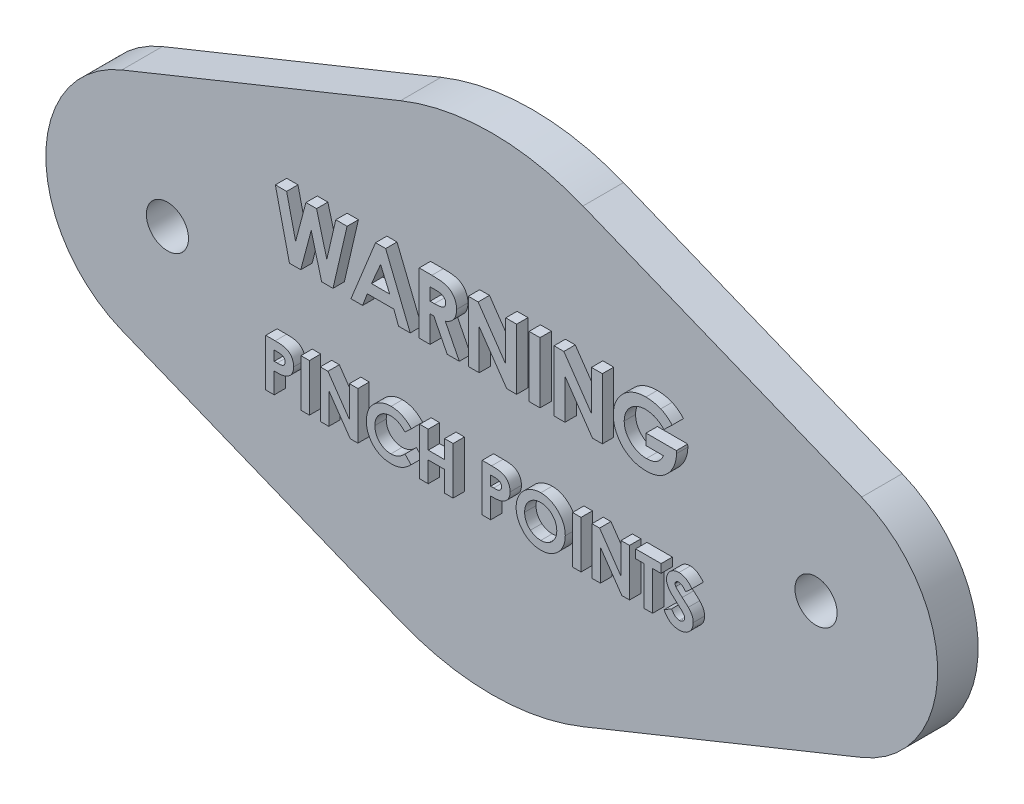
from build123d import *

# Parameters (mm, degrees)
SKETCH1_R                   = 38.1
SKETCH1_R_2                 = 19.05
BOSS_EXTRUDE1_DEPTH         = 6.35
SKETCH2_R                   = 3.302
CUT_EXTRUDE1_DEPTH          = 80.818262321
SKETCH3_W                   = 1.709615385
SKETCH3_H                   = 9.525
SKETCH3_W_2                 = 1.329700855
SKETCH3_H_2                 = 7.408333333
SKETCH3_W_3                 = 1.329700854
CUT_EXTRUDE2_DEPTH          = 0.254
BOSS_EXTRUDE2_DEPTH         = 1.778
BOSS_EXTRUDE2_DEPTH_BACK    = 0.254
BOSS_EXTRUDE2_2_DEPTH       = 1.778
BOSS_EXTRUDE2_2_DEPTH_BACK  = 0.254
BOSS_EXTRUDE2_3_DEPTH       = 1.778
BOSS_EXTRUDE2_3_DEPTH_BACK  = 0.254
BOSS_EXTRUDE2_4_DEPTH       = 1.778
BOSS_EXTRUDE2_4_DEPTH_BACK  = 0.254
BOSS_EXTRUDE2_5_DEPTH       = 1.778
BOSS_EXTRUDE2_5_DEPTH_BACK  = 0.254
SKETCH3_2_W                 = 1.709615385
SKETCH3_2_H                 = 9.525
BOSS_EXTRUDE2_6_DEPTH       = 1.778
BOSS_EXTRUDE2_6_DEPTH_BACK  = 0.254
BOSS_EXTRUDE2_7_DEPTH       = 1.778
BOSS_EXTRUDE2_7_DEPTH_BACK  = 0.254
BOSS_EXTRUDE2_8_DEPTH       = 1.778
BOSS_EXTRUDE2_8_DEPTH_BACK  = 0.254
BOSS_EXTRUDE2_9_DEPTH       = 1.778
BOSS_EXTRUDE2_9_DEPTH_BACK  = 0.254
SKETCH3_2_W_2               = 1.329700855
SKETCH3_2_H_2               = 7.408333333
BOSS_EXTRUDE2_10_DEPTH      = 1.778
BOSS_EXTRUDE2_10_DEPTH_BACK = 0.254
BOSS_EXTRUDE2_11_DEPTH      = 1.778
BOSS_EXTRUDE2_11_DEPTH_BACK = 0.254
BOSS_EXTRUDE2_12_DEPTH      = 1.778
BOSS_EXTRUDE2_12_DEPTH_BACK = 0.254
BOSS_EXTRUDE2_13_DEPTH      = 1.778
BOSS_EXTRUDE2_13_DEPTH_BACK = 0.254
BOSS_EXTRUDE2_14_DEPTH      = 1.778
BOSS_EXTRUDE2_14_DEPTH_BACK = 0.254
BOSS_EXTRUDE2_15_DEPTH      = 1.778
BOSS_EXTRUDE2_15_DEPTH_BACK = 0.254
SKETCH3_2_W_3               = 1.329700854
BOSS_EXTRUDE2_16_DEPTH      = 1.778
BOSS_EXTRUDE2_16_DEPTH_BACK = 0.254
BOSS_EXTRUDE2_17_DEPTH      = 1.778
BOSS_EXTRUDE2_17_DEPTH_BACK = 0.254
BOSS_EXTRUDE2_18_DEPTH      = 1.778
BOSS_EXTRUDE2_18_DEPTH_BACK = 0.254


with BuildPart() as part:
    # Sketch1 → Boss-Extrude1 (new body)
    with BuildSketch(Plane.XY):
        Circle(SKETCH1_R)
        with Locations((-50.8, 0)):
            Circle(SKETCH1_R_2)
        with Locations((-50.8, 0)):
            Circle(SKETCH1_R_2)
        Circle(SKETCH1_R)
        with BuildLine():
            Line((-14.2875, 35.319645295), (-57.94375, 17.659822647))
            ThreePointArc((-57.94375, 17.659822647), (-46.126174273, 18.467751706), (-36.115625, 12.135552351))
            ThreePointArc((-36.115625, 12.135552351), (-27.739760162, 26.117344929), (-14.2875, 35.319645295))
        make_face()
        with Locations((50.8, 0)):
            Circle(SKETCH1_R_2)
        Circle(SKETCH1_R)
        with Locations((-50.8, 0)):
            Circle(SKETCH1_R_2)
        with BuildLine():
            ThreePointArc((-36.115625, -12.135552351), (-46.126174273, -18.467751706), (-57.94375, -17.659822647))
            Line((-57.94375, -17.659822647), (-14.2875, -35.319645295))
            ThreePointArc((-14.2875, -35.319645295), (-27.739760162, -26.117344929), (-36.115625, -12.135552351))
        make_face()
        with BuildLine():
            ThreePointArc((36.115625, -12.135552351), (27.739760162, -26.117344929), (14.2875, -35.319645295))
            Line((14.2875, -35.319645295), (57.94375, -17.659822647))
            ThreePointArc((57.94375, -17.659822647), (46.126174273, -18.467751706), (36.115625, -12.135552351))
        make_face()
        with Locations((50.8, 0)):
            Circle(SKETCH1_R_2)
        Circle(SKETCH1_R)
        Circle(SKETCH1_R)
        with Locations((50.8, 0)):
            Circle(SKETCH1_R_2)
        with BuildLine():
            Line((57.94375, 17.659822647), (14.2875, 35.319645295))
            ThreePointArc((14.2875, 35.319645295), (27.739760162, 26.117344929), (36.115625, 12.135552351))
            ThreePointArc((36.115625, 12.135552351), (46.126174273, 18.467751706), (57.94375, 17.659822647))
        make_face()
    extrude(amount=BOSS_EXTRUDE1_DEPTH)

    # Sketch2 → Cut-Extrude1 (cut, through all)
    with BuildSketch(Plane.XY.offset(6.35)):
        with Locations((-50.8, 0)):
            Circle(SKETCH2_R)
        with Locations((50.8, 0)):
            Circle(SKETCH2_R)
    extrude(amount=-CUT_EXTRUDE1_DEPTH, mode=Mode.SUBTRACT)

    # Sketch3 → Cut-Extrude2 (cut)
    # profile 1 of 18: a face of its own
    with BuildSketch(Plane.XY.offset(6.35)):
        Polygon((-32.116346154, 15.875), (-30.351397236, 15.875), (-28.941346154, 9.794035457), (-27.325225361, 15.875), (-25.663311298, 15.875), (-24.056730769, 9.794035457), (-22.650495793, 15.875), (-20.881730769, 15.875), (-23.085531851, 6.35), (-24.871469351, 6.35), (-26.499038462, 12.507286659), (-28.136147837, 6.35), (-29.908728966, 6.35), align=None)
    # profile 2 of 18: a face of its own
    with BuildSketch(Plane.XY.offset(6.35)):
        Polygon((-16.422611178, 15.875), (-14.837019231, 15.875), (-10.990384615, 6.35), (-12.816391226, 6.35), (-13.556715745, 8.303846154), (-17.706730769, 8.303846154), (-18.447055288, 6.35), (-20.271153846, 6.35), align=None)
        Polygon((-15.630769231, 13.320117187), (-17.057992788, 10.013461538), (-14.203545673, 10.013461538), align=None, mode=Mode.SUBTRACT)
    # profile 3 of 18: a face of its own
    with BuildSketch(Plane.XY.offset(6.35)):
        with BuildLine():
            Line((-9.586057692, 15.875), (-7.594050481, 15.875))
            add(Edge.make_bspline(
                [(-7.594050481, 15.875), (-7.46237941, 15.874532643), (-7.209138852, 15.873633785), (-6.8439798, 15.859452176), (-6.508530992, 15.839717304), (-6.202295767, 15.809601365), (-5.925405138, 15.769671271), (-5.677581595, 15.722600298), (-5.458832382, 15.668952831), (-5.267312651, 15.602103856), (-5.094475565, 15.526699225), (-4.933367371, 15.440057921), (-4.780433784, 15.343144724), (-4.636697, 15.233409583), (-4.500907911, 15.112826607), (-4.372810345, 14.981274418), (-4.254214437, 14.837637507), (-4.145854539, 14.682823478), (-4.047093215, 14.519962669), (-3.959808918, 14.348831472), (-3.888829182, 14.169310876), (-3.826110977, 13.983995342), (-3.780937086, 13.790235748), (-3.749519305, 13.589918376), (-3.726516435, 13.382338089), (-3.72519388, 13.241317258), (-3.724519231, 13.16938101)],
                knots=[0, 0, 0, 0, 1.749336639, 3.364467119, 4.854658419, 6.213483162, 7.451590619, 8.570285859, 9.5643256, 10.440900261, 11.26203566, 12.067320669, 12.869050712, 13.665104639, 14.467235401, 15.27997916, 16.102287765, 16.939272006, 17.78853747, 18.631303466, 19.488103222, 20.351255419, 21.228522269, 22.127379805, 23.044756219, 24, 24, 24, 24], degree=3))
            add(Edge.make_bspline(
                [(-3.724519231, 13.16938101), (-3.726271728, 13.094296092), (-3.729708055, 12.947068252), (-3.748217984, 12.730802564), (-3.782048318, 12.523894681), (-3.833289282, 12.326950403), (-3.892184114, 12.13751853), (-3.970499134, 11.959094198), (-4.058885374, 11.789082484), (-4.163859128, 11.629888267), (-4.279062696, 11.477975527), (-4.413042021, 11.339164603), (-4.557117302, 11.205994935), (-4.719387536, 11.086807818), (-4.892699698, 10.973544251), (-5.080497321, 10.870897296), (-5.281554772, 10.776286644), (-5.422908116, 10.72352521), (-5.495192308, 10.696544471)],
                knots=[0, 0, 0, 0, 1.099860209, 2.156625411, 3.176576793, 4.16617041, 5.135385252, 6.078461593, 7.016046972, 7.938469504, 8.868247731, 9.803980173, 10.76021508, 11.73834243, 12.748633912, 13.790971185, 14.870363756, 16, 16, 16, 16], degree=3))
            Line((-5.495192308, 10.696544471), (-3.297115385, 6.35))
            Line((-3.297115385, 6.35), (-5.197536058, 6.35))
            Line((-5.197536058, 6.35), (-7.296394231, 10.501923077))
            Line((-7.296394231, 10.501923077), (-7.876442308, 10.501923077))
            Line((-7.876442308, 10.501923077), (-7.876442308, 6.35))
            Line((-7.876442308, 6.35), (-9.586057692, 6.35))
            Line((-9.586057692, 6.35), (-9.586057692, 15.875))
        make_face()
        with BuildLine():
            Line((-7.876442308, 12.211538462), (-7.210531851, 12.211538462))
            add(Edge.make_bspline(
                [(-7.210531851, 12.211538462), (-7.129118762, 12.21245539), (-6.973230191, 12.214211112), (-6.749041951, 12.222354878), (-6.545425562, 12.241977329), (-6.361506629, 12.266769563), (-6.196359686, 12.295395778), (-6.051457787, 12.336418881), (-5.924568215, 12.380376175), (-5.817194616, 12.435003688), (-5.72545708, 12.497127019), (-5.646247589, 12.567700667), (-5.580729983, 12.649380679), (-5.526805651, 12.739947343), (-5.484858383, 12.840201701), (-5.454240092, 12.949043185), (-5.437128995, 13.067711641), (-5.435160305, 13.149609034), (-5.434134615, 13.192277644)],
                knots=[0, 0, 0, 0, 1.688639943, 3.233382647, 4.650958383, 5.928841754, 7.082724185, 8.122798841, 9.049171256, 9.863274652, 10.613301712, 11.341792392, 12.054588806, 12.776240173, 13.521029143, 14.301969904, 15.115324896, 16, 16, 16, 16], degree=3))
            add(Edge.make_bspline(
                [(-5.434134615, 13.192277644), (-5.436073775, 13.242757725), (-5.439882894, 13.34191649), (-5.477681189, 13.484670342), (-5.537847911, 13.616798799), (-5.620320007, 13.737704871), (-5.72418289, 13.843699481), (-5.843373743, 13.937134574), (-5.980464992, 14.011016054), (-6.107401173, 14.059747491), (-6.222883427, 14.088904013), (-6.327102517, 14.110631195), (-6.447788852, 14.126029873), (-6.585033541, 14.142362912), (-6.738486745, 14.15295406), (-6.908984875, 14.160683488), (-7.096038261, 14.163845977), (-7.226432237, 14.164856968), (-7.294486178, 14.165384615)],
                knots=[0, 0, 0, 0, 1.020303359, 2.004196876, 2.966617323, 3.9489082, 4.950758222, 5.960522915, 7.003732012, 8.091992268, 8.70421221, 9.413913587, 10.24622431, 11.166358409, 12.212345909, 13.359657661, 14.621978493, 16, 16, 16, 16], degree=3))
            Line((-7.294486178, 14.165384615), (-7.876442308, 14.165384615))
            Line((-7.876442308, 14.165384615), (-7.876442308, 12.211538462))
        make_face(mode=Mode.SUBTRACT)
    # profile 4 of 18: a face of its own
    with BuildSketch(Plane.XY.offset(6.35)):
        Polygon((-1.892788462, 15.875), (-0.352989784, 15.875), (3.96875, 9.607046274), (3.96875, 15.875), (5.678365385, 15.875), (5.678365385, 6.35), (4.127118389, 6.35), (-0.183173077, 12.598873197), (-0.183173077, 6.35), (-1.892788462, 6.35), align=None)
    # profile 5 of 18: a face of its own
    with BuildSketch(Plane.XY.offset(6.35)):
        with Locations((8.487019231, 11.1125)):
            Rectangle(SKETCH3_W, SKETCH3_H)
    # profile 6 of 18: a face of its own
    with BuildSketch(Plane.XY.offset(6.35)):
        Polygon((11.539903846, 15.875), (13.079702524, 15.875), (17.401442308, 9.607046274), (17.401442308, 15.875), (19.111057692, 15.875), (19.111057692, 6.35), (17.559810697, 6.35), (13.249519231, 12.598873197), (13.249519231, 6.35), (11.539903846, 6.35), align=None)
    # profile 7 of 18: a face of its own
    with BuildSketch(Plane.XY.offset(6.35)):
        with BuildLine():
            Line((30.038476563, 14.36000601), (28.744816707, 13.121679687))
            add(Edge.make_bspline(
                [(28.744816707, 13.121679687), (28.642395399, 13.224223714), (28.441427883, 13.425432025), (28.112770651, 13.687318468), (27.772381503, 13.909973718), (27.419140083, 14.093056439), (27.052554322, 14.235071314), (26.673347651, 14.336659099), (26.28090315, 14.396912535), (26.01523574, 14.405347811), (25.880829327, 14.409615385)],
                knots=[0, 0, 0, 0, 1.075575784, 2.110457258, 3.113929901, 4.09197124, 5.059417775, 6.02750972, 7.002078037, 8, 8, 8, 8], degree=3))
            add(Edge.make_bspline(
                [(25.880829327, 14.409615385), (25.764303076, 14.406625115), (25.535493568, 14.400753459), (25.199280033, 14.356164505), (24.878007406, 14.281680662), (24.570157861, 14.178495735), (24.277610927, 14.044219532), (23.998671532, 13.880924449), (23.735056273, 13.687361265), (23.488840928, 13.467199265), (23.264661065, 13.226826813), (23.068940206, 12.969543291), (22.902228082, 12.700144248), (22.764990004, 12.417251396), (22.660566751, 12.121298922), (22.586022212, 11.812501671), (22.538704967, 11.491757051), (22.533118214, 11.27294175), (22.530288462, 11.162109375)],
                knots=[0, 0, 0, 0, 1.075001177, 2.110859044, 3.123021556, 4.114053297, 5.101481495, 6.087880186, 7.091499647, 8.114004866, 9.131394192, 10.11971144, 11.092043119, 12.050101265, 13.015322563, 13.981809771, 14.977764287, 16, 16, 16, 16], degree=3))
            add(Edge.make_bspline(
                [(22.530288462, 11.162109375), (22.532927919, 11.047440943), (22.538128012, 10.821528434), (22.588080783, 10.489992116), (22.665041628, 10.171030287), (22.777691784, 9.86700957), (22.91633001, 9.573765307), (23.092146122, 9.296977917), (23.297165303, 9.032420553), (23.531021212, 8.784699312), (23.78539605, 8.556359945), (24.060892274, 8.35938853), (24.349127603, 8.189444716), (24.654754167, 8.054854709), (24.972467193, 7.946793677), (25.305489204, 7.870601376), (25.653070315, 7.823857664), (25.890221773, 7.81823708), (26.010576923, 7.815384615)],
                knots=[0, 0, 0, 0, 1.022067601, 2.013613092, 2.983553406, 3.943623673, 4.90013463, 5.87121881, 6.861774014, 7.881098904, 8.905697761, 9.905387765, 10.89678721, 11.884561068, 12.87834324, 13.885584958, 14.926927371, 16, 16, 16, 16], degree=3))
            add(Edge.make_bspline(
                [(26.010576923, 7.815384615), (26.088863491, 7.816090982), (26.242557443, 7.817477735), (26.468000279, 7.839988652), (26.683920367, 7.872170624), (26.891153906, 7.914775733), (27.087608393, 7.975069608), (27.276003874, 8.04557587), (27.455236519, 8.128787317), (27.624334547, 8.2275749), (27.785814626, 8.338303705), (27.938165272, 8.465001005), (28.084058895, 8.604810242), (28.221790746, 8.759439382), (28.349029673, 8.930270995), (28.469852089, 9.11416582), (28.582874598, 9.312948902), (28.649656617, 9.453319446), (28.683759014, 9.525)],
                knots=[0, 0, 0, 0, 1.109579412, 2.178351274, 3.208885622, 4.204702371, 5.174744997, 6.119429583, 7.05542196, 7.97267548, 8.893247984, 9.828544973, 10.778894627, 11.756245826, 12.760884819, 13.796418446, 14.874735809, 16, 16, 16, 16], degree=3))
            Line((28.683759014, 9.525), (25.949519231, 9.525))
            Line((25.949519231, 9.525), (25.949519231, 11.234615385))
            Line((25.949519231, 11.234615385), (30.698662861, 11.234615385))
            Line((30.698662861, 11.234615385), (30.712019231, 10.82820012))
            add(Edge.make_bspline(
                [(30.712019231, 10.82820012), (30.710303037, 10.723822368), (30.706873711, 10.515253136), (30.675533271, 10.20472908), (30.62361831, 9.898323482), (30.552645589, 9.596344087), (30.463698816, 9.297309579), (30.350263838, 9.004083462), (30.21743217, 8.714677174), (30.068603711, 8.430320468), (29.901363345, 8.157472477), (29.721304534, 7.899121447), (29.530994139, 7.655714529), (29.326292988, 7.43064299), (29.110388616, 7.222016131), (28.882856011, 7.030636564), (28.642890402, 6.856342358), (28.391762984, 6.697661125), (28.128043343, 6.558586387), (27.85318141, 6.437609816), (27.567592189, 6.334866967), (27.270538354, 6.250640182), (26.962604435, 6.185652517), (26.643783835, 6.14109039), (26.313901453, 6.110809923), (26.090149211, 6.107469775), (25.976231971, 6.105769231)],
                knots=[0, 0, 0, 0, 1.006889344, 2.011981806, 3.007738725, 4.003571281, 5.003404394, 6.015442001, 7.03424805, 8.074616296, 9.110249922, 10.119753985, 11.111721717, 12.089233633, 13.052717867, 14.006597561, 14.955430184, 15.912305663, 16.870361111, 17.829300583, 18.807640451, 19.796414044, 20.806216501, 21.841577364, 22.90109906, 24, 24, 24, 24], degree=3))
            add(Edge.make_bspline(
                [(25.976231971, 6.105769231), (25.85469, 6.107448549), (25.613757561, 6.11077746), (25.25750666, 6.141954972), (24.911590819, 6.193411444), (24.575923759, 6.264625443), (24.249726129, 6.353256953), (23.933558386, 6.464510464), (23.628067179, 6.596850032), (23.332337705, 6.746771257), (23.050149708, 6.916794985), (22.782135618, 7.10393983), (22.529758306, 7.309409609), (22.290432646, 7.529764714), (22.069750211, 7.770421494), (21.859487028, 8.023579096), (21.66982963, 8.298522329), (21.492623311, 8.586337455), (21.335191801, 8.886903863), (21.197515682, 9.194662423), (21.080105566, 9.507831211), (20.987524852, 9.827868445), (20.912357982, 10.152542559), (20.858574676, 10.483265485), (20.828200731, 10.819995823), (20.823193434, 11.046296053), (20.820673077, 11.160201322)],
                knots=[0, 0, 0, 0, 1.084149091, 2.14910686, 3.187506334, 4.202448172, 5.208724393, 6.201130722, 7.189831603, 8.176984443, 9.156919086, 10.126598231, 11.090766514, 12.05840148, 13.026036446, 14.001772938, 14.991905635, 16.003017641, 17.015720547, 18.016462227, 19.009322657, 19.99686681, 20.986544154, 21.980959929, 22.983742515, 24, 24, 24, 24], degree=3))
            add(Edge.make_bspline(
                [(20.820673077, 11.160201322), (20.824048374, 11.31559245), (20.830713584, 11.622443858), (20.892443544, 12.074437928), (20.988671356, 12.511697091), (21.126767954, 12.932628879), (21.3039785, 13.33781313), (21.517792646, 13.728201034), (21.772854899, 14.103377642), (21.970290601, 14.335664069), (22.070447716, 14.453500601)],
                knots=[0, 0, 0, 0, 1.034044851, 2.041932006, 3.031217818, 4.011390712, 4.986069675, 5.97149666, 6.970960976, 8, 8, 8, 8], degree=3))
            add(Edge.make_bspline(
                [(22.070447716, 14.453500601), (22.13263429, 14.521672606), (22.256073705, 14.656993011), (22.453391384, 14.845023467), (22.655713095, 15.021779053), (22.865841025, 15.183511775), (23.082670572, 15.333762043), (23.306825807, 15.469713294), (23.537130866, 15.595694288), (23.775381849, 15.705271959), (24.020331478, 15.803517482), (24.273064597, 15.886647008), (24.531688288, 15.96028001), (24.798492671, 16.016295838), (25.070782385, 16.062941546), (25.350490234, 16.094205942), (25.636853998, 16.117120518), (25.830536045, 16.118521788), (25.928530649, 16.119230769)],
                knots=[0, 0, 0, 0, 1.020590567, 2.025856924, 3.013483481, 3.991664875, 4.957826714, 5.930500614, 6.890802512, 7.860442893, 8.829981142, 9.809047939, 10.802672283, 11.803273349, 12.823572789, 13.857849586, 14.916166035, 16, 16, 16, 16], degree=3))
            add(Edge.make_bspline(
                [(25.928530649, 16.119230769), (26.030966826, 16.117651027), (26.234777203, 16.114507921), (26.537809483, 16.092759674), (26.836630926, 16.059207257), (27.12998227, 16.008876714), (27.418848003, 15.946808679), (27.701732887, 15.867284164), (27.980482395, 15.77692999), (28.161947269, 15.704892968), (28.252539063, 15.668930288)],
                knots=[0, 0, 0, 0, 1.03180557, 2.052914215, 3.058998889, 4.059601663, 5.049854447, 6.033765722, 7.018406786, 8, 8, 8, 8], degree=3))
            add(Edge.make_bspline(
                [(28.252539063, 15.668930288), (28.32876085, 15.6356943), (28.483793858, 15.568093218), (28.709347776, 15.444413868), (28.935452784, 15.307301115), (29.159669095, 15.151741796), (29.381655064, 14.978026881), (29.603728462, 14.788900166), (29.823622285, 14.582156326), (29.965930965, 14.435015117), (30.038476563, 14.36000601)],
                knots=[0, 0, 0, 0, 0.894392155, 1.819168899, 2.76525314, 3.739198753, 4.75366411, 5.797420238, 6.877176959, 8, 8, 8, 8], degree=3))
        make_face()
    # profile 8 of 18: a face of its own
    with BuildSketch(Plane.XY.offset(6.35)):
        with BuildLine():
            Line((-33.622435897, -5.291666667), (-32.138394765, -5.291666667))
            add(Edge.make_bspline(
                [(-32.138394765, -5.291666667), (-32.041429443, -5.292100704), (-31.854363011, -5.292938053), (-31.584597825, -5.303092026), (-31.335726233, -5.321288563), (-31.107805412, -5.343776605), (-30.900929078, -5.375303965), (-30.714838159, -5.411447615), (-30.549494038, -5.455481101), (-30.403032212, -5.507748237), (-30.271587455, -5.569369149), (-30.14719832, -5.634999819), (-30.032676015, -5.713327709), (-29.922240254, -5.795910971), (-29.822204839, -5.890638753), (-29.726328962, -5.991206783), (-29.638673229, -6.101603508), (-29.558831475, -6.220492604), (-29.486402702, -6.345677508), (-29.42312408, -6.477382016), (-29.371796005, -6.615814535), (-29.328738133, -6.760079564), (-29.294153631, -6.910170815), (-29.271133085, -7.067011364), (-29.255496372, -7.229506091), (-29.254116648, -7.340100104), (-29.253418803, -7.396036993)],
                knots=[0, 0, 0, 0, 1.698747864, 3.27724071, 4.728299578, 6.070144658, 7.288476769, 8.393259625, 9.389771311, 10.283485332, 11.113357557, 11.931608583, 12.74405601, 13.541433047, 14.344816069, 15.154114104, 15.974336324, 16.810834471, 17.661136416, 18.50621059, 19.367396281, 20.244825668, 21.142564693, 22.063065223, 23.020325768, 24, 24, 24, 24], degree=3))
            add(Edge.make_bspline(
                [(-29.253418803, -7.396036993), (-29.254428498, -7.457918641), (-29.256412671, -7.579523683), (-29.275863962, -7.757781757), (-29.309092912, -7.927734691), (-29.352521413, -8.090815728), (-29.413079368, -8.244341825), (-29.482263989, -8.391976161), (-29.567383016, -8.529579523), (-29.664645113, -8.658873162), (-29.770866418, -8.780908297), (-29.888568622, -8.892161395), (-30.01550827, -8.993390864), (-30.150950553, -9.085657596), (-30.295403962, -9.168775469), (-30.448764268, -9.243522794), (-30.6120787, -9.307508919), (-30.725805958, -9.340973145), (-30.783465211, -9.35793937)],
                knots=[0, 0, 0, 0, 1.102006807, 2.165578795, 3.188629044, 4.184801286, 5.166646146, 6.124351954, 7.085497154, 8.042432466, 9.003981491, 9.963833307, 10.922997304, 11.89326795, 12.880200226, 13.889073926, 14.929769137, 16, 16, 16, 16], degree=3))
            add(Edge.make_bspline(
                [(-30.783465211, -9.35793937), (-30.821442912, -9.367388283), (-30.903714842, -9.387857672), (-31.039852288, -9.40863924), (-31.196736402, -9.427746614), (-31.374874491, -9.444167089), (-31.574369257, -9.455329185), (-31.795027536, -9.464046286), (-32.036949328, -9.470384519), (-32.205172175, -9.470609427), (-32.292735043, -9.470726496)],
                knots=[0, 0, 0, 0, 0.618981996, 1.340914327, 2.176866532, 3.120127938, 4.170906482, 5.338178032, 6.614476169, 8, 8, 8, 8], degree=3))
            Line((-32.292735043, -9.470726496), (-32.292735043, -12.7))
            Line((-32.292735043, -12.7), (-33.622435897, -12.7))
            Line((-33.622435897, -12.7), (-33.622435897, -5.291666667))
        make_face()
        with BuildLine():
            Line((-32.292735043, -8.141025641), (-31.822294004, -8.141025641))
            add(Edge.make_bspline(
                [(-31.822294004, -8.141025641), (-31.736689829, -8.140482844), (-31.579176877, -8.13948409), (-31.364069807, -8.125041521), (-31.191205628, -8.102984801), (-31.054639716, -8.071350364), (-30.946807994, -8.023340917), (-30.853809885, -7.967803027), (-30.774043032, -7.89757689), (-30.704976678, -7.817331512), (-30.64976021, -7.725125551), (-30.611470465, -7.622460402), (-30.586598199, -7.51149317), (-30.584301014, -7.434267321), (-30.583119658, -7.394552951)],
                knots=[0, 0, 0, 0, 1.8619151, 3.425951444, 4.686033666, 5.651700536, 6.461346321, 7.243864085, 7.999046032, 8.762387399, 9.539336099, 10.322741239, 11.137448474, 12, 12, 12, 12], degree=3))
            add(Edge.make_bspline(
                [(-30.583119658, -7.394552951), (-30.584288863, -7.359855024), (-30.5865574, -7.292532702), (-30.603222696, -7.195369894), (-30.629782383, -7.104794113), (-30.668266349, -7.021751303), (-30.718017005, -6.946382567), (-30.778673122, -6.878717596), (-30.849456363, -6.817307287), (-30.904105164, -6.784801872), (-30.931869324, -6.768287593)],
                knots=[0, 0, 0, 0, 1.102301479, 2.1387299, 3.123554645, 4.094223062, 5.036071848, 5.982632524, 6.975082478, 8, 8, 8, 8], degree=3))
            add(Edge.make_bspline(
                [(-30.931869324, -6.768287593), (-30.95538717, -6.756393944), (-31.00517927, -6.731212652), (-31.089980044, -6.701937558), (-31.187838841, -6.677240791), (-31.29941632, -6.656742713), (-31.424267365, -6.640834076), (-31.562369702, -6.628667948), (-31.71392656, -6.623775475), (-31.819325287, -6.622192311), (-31.874235443, -6.621367521)],
                knots=[0, 0, 0, 0, 0.656809284, 1.390599849, 2.23162475, 3.173112763, 4.218524733, 5.370385145, 6.63003504, 8, 8, 8, 8], degree=3))
            Line((-31.874235443, -6.621367521), (-32.292735043, -6.621367521))
            Line((-32.292735043, -6.621367521), (-32.292735043, -8.141025641))
        make_face(mode=Mode.SUBTRACT)
    # profile 9 of 18: a face of its own
    with BuildSketch(Plane.XY.offset(6.35)):
        with Locations((-27.448824787, -8.995833334)):
            Rectangle(SKETCH3_W_2, SKETCH3_H_2)
    # profile 10 of 18: a face of its own
    with BuildSketch(Plane.XY.offset(6.35)):
        Polygon((-25.074358974, -5.291666667), (-23.87673778, -5.291666667), (-20.515384615, -10.166741787), (-20.515384615, -5.291666667), (-19.185683761, -5.291666667), (-19.185683761, -12.7), (-20.392209201, -12.7), (-23.74465812, -7.839765291), (-23.74465812, -12.7), (-25.074358974, -12.7), align=None)
    # profile 11 of 18: a face of its own
    with BuildSketch(Plane.XY.offset(6.35)):
        with BuildLine():
            Line((-10.827564103, -6.576846287), (-11.802579127, -7.508824119))
            add(Edge.make_bspline(
                [(-11.802579127, -7.508824119), (-11.885287844, -7.423303166), (-12.046843881, -7.256253953), (-12.307171455, -7.035095516), (-12.577902653, -6.850789882), (-12.853770941, -6.695568852), (-13.139738388, -6.578133079), (-13.432498433, -6.492555654), (-13.733920435, -6.440382332), (-13.937911252, -6.43441278), (-14.040513154, -6.431410256)],
                knots=[0, 0, 0, 0, 1.115251505, 2.178435587, 3.19620269, 4.182487026, 5.141301733, 6.088180966, 7.038406374, 8, 8, 8, 8], degree=3))
            add(Edge.make_bspline(
                [(-14.040513154, -6.431410256), (-14.126198211, -6.433782355), (-14.29528823, -6.438463431), (-14.543556689, -6.472780334), (-14.7810383, -6.531137722), (-15.008546001, -6.611565011), (-15.22541034, -6.715633656), (-15.432086002, -6.843263108), (-15.628063436, -6.993300693), (-15.810753892, -7.164970109), (-15.977872702, -7.352531846), (-16.125532811, -7.552659772), (-16.249221838, -7.764895406), (-16.350731411, -7.98708938), (-16.429803444, -8.220270118), (-16.48627081, -8.464280634), (-16.518930026, -8.719411526), (-16.523804633, -8.892847605), (-16.526282051, -8.980992922)],
                knots=[0, 0, 0, 0, 1.035432265, 2.043311493, 3.022114605, 3.98653278, 4.95457646, 5.923598177, 6.917315552, 7.932509744, 8.948865224, 9.949768934, 10.933144597, 11.912367597, 12.897413939, 13.903909035, 14.934704909, 16, 16, 16, 16], degree=3))
            add(Edge.make_bspline(
                [(-16.526282051, -8.980992922), (-16.525568088, -9.042859473), (-16.52416085, -9.164799716), (-16.50875615, -9.34518318), (-16.483950949, -9.520197784), (-16.448051679, -9.689578428), (-16.403159288, -9.853471899), (-16.350490291, -10.013292098), (-16.28441781, -10.16683067), (-16.211076359, -10.315870865), (-16.125781097, -10.456345934), (-16.033817069, -10.590300572), (-15.934097095, -10.717078144), (-15.825975284, -10.836160382), (-15.707929955, -10.945686295), (-15.583012143, -11.04894946), (-15.449114658, -11.143364848), (-15.309018889, -11.231301918), (-15.161514587, -11.307693599), (-15.010603884, -11.376889704), (-14.853998672, -11.433087228), (-14.693605711, -11.47838756), (-14.52999819, -11.516908727), (-14.361575876, -11.540627393), (-14.189798779, -11.558589262), (-14.073706294, -11.559698302), (-14.015284455, -11.56025641)],
                knots=[0, 0, 0, 0, 1.103660481, 2.175337485, 3.227646561, 4.255952547, 5.262355991, 6.258840057, 7.255597736, 8.242457506, 9.22035537, 10.185017736, 11.140346927, 12.096287581, 13.051739095, 14.01125915, 14.986044842, 15.97314143, 16.960198552, 17.947847494, 18.933482797, 19.925264591, 20.920966487, 21.929612487, 22.958107872, 24, 24, 24, 24], degree=3))
            add(Edge.make_bspline(
                [(-14.015284455, -11.56025641), (-13.916190976, -11.557390101), (-13.721498058, -11.551758549), (-13.435758205, -11.507720606), (-13.163476593, -11.435280684), (-12.945924888, -11.349733344), (-12.775478873, -11.265254235), (-12.645720842, -11.18711522), (-12.511540924, -11.099708153), (-12.375167734, -10.999734195), (-12.235067343, -10.888393075), (-12.093712846, -10.763246215), (-11.947485544, -10.62841452), (-11.851693487, -10.532182491), (-11.802579127, -10.482842548)],
                knots=[0, 0, 0, 0, 1.404581149, 2.759636711, 4.088442092, 5.392261763, 6.066678138, 6.783632037, 7.538459478, 8.336747902, 9.180226004, 10.074962426, 11.012997595, 12, 12, 12, 12], degree=3))
            Line((-11.802579127, -10.482842548), (-10.857244925, -11.475666066))
            add(Edge.make_bspline(
                [(-10.857244925, -11.475666066), (-10.923696831, -11.539823295), (-11.053396741, -11.665044485), (-11.249045453, -11.842846891), (-11.444447934, -12.002622118), (-11.634883667, -12.150169307), (-11.823472187, -12.28119005), (-12.010193495, -12.395815199), (-12.192933823, -12.496943789), (-12.375487835, -12.582870337), (-12.558991474, -12.6558309), (-12.747795154, -12.718645156), (-12.942476066, -12.771783757), (-13.144223232, -12.81465963), (-13.351154876, -12.849040291), (-13.565207605, -12.872247038), (-13.785024218, -12.887848163), (-13.934129233, -12.889250053), (-14.009348291, -12.889957265)],
                knots=[0, 0, 0, 0, 1.244526981, 2.429050516, 3.560637417, 4.644440555, 5.67424972, 6.652764056, 7.595344123, 8.486817594, 9.369275933, 10.254498637, 11.166417451, 12.086725134, 13.032340136, 13.991389299, 14.986715468, 16, 16, 16, 16], degree=3))
            add(Edge.make_bspline(
                [(-14.009348291, -12.889957265), (-14.147516383, -12.886435085), (-14.417872933, -12.879543157), (-14.814073407, -12.82847864), (-15.190453223, -12.742869876), (-15.547928041, -12.621795471), (-15.886384193, -12.467128593), (-16.205735092, -12.277514263), (-16.505466014, -12.053456256), (-16.783155724, -11.797580751), (-17.034339283, -11.514987735), (-17.25635646, -11.211560363), (-17.440009078, -10.885807401), (-17.592499803, -10.542541259), (-17.711745545, -10.180195481), (-17.795674332, -9.798378121), (-17.847432602, -9.397457844), (-17.853095031, -9.123620054), (-17.855982906, -8.983961004)],
                knots=[0, 0, 0, 0, 1.078019885, 2.10938526, 3.111377082, 4.085535484, 5.04941344, 6.010039228, 6.978205633, 7.964457913, 8.951525778, 9.924444315, 10.892603023, 11.863865945, 12.85144698, 13.863884204, 14.910567087, 16, 16, 16, 16], degree=3))
            add(Edge.make_bspline(
                [(-17.855982906, -8.983961004), (-17.85476263, -8.892876564), (-17.852344341, -8.712369464), (-17.8269279, -8.446467882), (-17.791495903, -8.187261403), (-17.735286263, -7.937441447), (-17.667531085, -7.69364248), (-17.583268619, -7.458514312), (-17.482633444, -7.231381161), (-17.368869269, -7.011862792), (-17.240168996, -6.801397286), (-17.096396662, -6.601792872), (-16.941253528, -6.411508643), (-16.771011757, -6.233069071), (-16.588145185, -6.064907422), (-16.391828191, -5.907934996), (-16.183241523, -5.759900632), (-15.961820614, -5.624621777), (-15.731867083, -5.502254862), (-15.49628125, -5.394322017), (-15.25564192, -5.304115013), (-15.01096654, -5.229291631), (-14.761221358, -5.173441268), (-14.508188992, -5.131164344), (-14.249716441, -5.107531273), (-14.076174515, -5.103662389), (-13.988571715, -5.101709402)],
                knots=[0, 0, 0, 0, 1.071919942, 2.124283339, 3.142214191, 4.149696895, 5.136002878, 6.119640489, 7.086990633, 8.058538607, 9.028339693, 9.988281803, 10.952401235, 11.916291999, 12.888973767, 13.874849856, 14.873389453, 15.898127285, 16.927174885, 17.938320013, 18.946391617, 19.950418109, 20.947802303, 21.956882652, 22.968648068, 24, 24, 24, 24], degree=3))
            add(Edge.make_bspline(
                [(-13.988571715, -5.101709402), (-13.913837544, -5.102828903), (-13.76514623, -5.105056265), (-13.543719912, -5.12362375), (-13.324064458, -5.152783799), (-13.106966301, -5.196780102), (-12.890872535, -5.249009274), (-12.678622873, -5.31739617), (-12.466868962, -5.393626253), (-12.258931848, -5.484743752), (-12.054521281, -5.584206733), (-11.8584259, -5.697051097), (-11.667353283, -5.816332528), (-11.485537482, -5.949110623), (-11.309572699, -6.090569274), (-11.140379066, -6.241368466), (-10.979441358, -6.404022463), (-10.878445789, -6.518947114), (-10.827564103, -6.576846287)],
                knots=[0, 0, 0, 0, 0.996412454, 1.982464992, 2.961075852, 3.949442424, 4.934965278, 5.923860011, 6.921385422, 7.934793307, 8.949617135, 9.951082467, 10.950285876, 11.951772932, 12.951063433, 13.960125323, 14.972308753, 16, 16, 16, 16], degree=3))
        make_face()
    # profile 12 of 18: a face of its own
    with BuildSketch(Plane.XY.offset(6.35)):
        Polygon((-9.497863248, -5.291666667), (-8.168162393, -5.291666667), (-8.168162393, -8.141025641), (-5.603739316, -8.141025641), (-5.603739316, -5.291666667), (-4.274038462, -5.291666667), (-4.274038462, -12.7), (-5.603739316, -12.7), (-5.603739316, -9.470726496), (-8.168162393, -9.470726496), (-8.168162393, -12.7), (-9.497863248, -12.7), align=None)
    # profile 13 of 18: a face of its own
    with BuildSketch(Plane.XY.offset(6.35)):
        with BuildLine():
            Line((0.284935897, -5.291666667), (1.76897703, -5.291666667))
            add(Edge.make_bspline(
                [(1.76897703, -5.291666667), (1.865942352, -5.292100704), (2.053008784, -5.292938053), (2.32277397, -5.303092026), (2.571645562, -5.321288563), (2.799566383, -5.343776605), (3.006442717, -5.375303965), (3.192533636, -5.411447615), (3.357877757, -5.455481101), (3.504339583, -5.507748237), (3.63578434, -5.569369149), (3.760173475, -5.634999819), (3.87469578, -5.713327709), (3.985131541, -5.795910971), (4.085166956, -5.890638753), (4.181042833, -5.991206783), (4.268698566, -6.101603508), (4.34854032, -6.220492604), (4.420969093, -6.345677508), (4.484247715, -6.477382016), (4.53557579, -6.615814535), (4.578633662, -6.760079564), (4.613218164, -6.910170815), (4.63623871, -7.067011364), (4.651875423, -7.229506091), (4.653255147, -7.340100104), (4.653952991, -7.396036993)],
                knots=[0, 0, 0, 0, 1.698747864, 3.27724071, 4.728299578, 6.070144658, 7.288476769, 8.393259625, 9.389771311, 10.283485332, 11.113357557, 11.931608583, 12.74405601, 13.541433047, 14.344816069, 15.154114104, 15.974336324, 16.810834471, 17.661136416, 18.50621059, 19.367396281, 20.244825668, 21.142564693, 22.063065223, 23.020325768, 24, 24, 24, 24], degree=3))
            add(Edge.make_bspline(
                [(4.653952991, -7.396036993), (4.652943297, -7.457918641), (4.650959124, -7.579523683), (4.631507833, -7.757781757), (4.598278882, -7.927734691), (4.554850382, -8.090815728), (4.494292427, -8.244341825), (4.425107806, -8.391976161), (4.339988779, -8.529579523), (4.242726682, -8.658873162), (4.136505376, -8.780908297), (4.018803173, -8.892161395), (3.891863525, -8.993390864), (3.756421242, -9.085657596), (3.611967833, -9.168775469), (3.458607527, -9.243522794), (3.295293094, -9.307508919), (3.181565837, -9.340973145), (3.123906584, -9.35793937)],
                knots=[0, 0, 0, 0, 1.102006807, 2.165578795, 3.188629044, 4.184801286, 5.166646146, 6.124351954, 7.085497154, 8.042432466, 9.003981491, 9.963833307, 10.922997304, 11.89326795, 12.880200226, 13.889073926, 14.929769137, 16, 16, 16, 16], degree=3))
            add(Edge.make_bspline(
                [(3.123906584, -9.35793937), (3.085928883, -9.367388283), (3.003656953, -9.387857672), (2.867519507, -9.40863924), (2.710635393, -9.427746614), (2.532497304, -9.444167089), (2.333002538, -9.455329185), (2.112344259, -9.464046286), (1.870422467, -9.470384519), (1.70219962, -9.470609427), (1.614636752, -9.470726496)],
                knots=[0, 0, 0, 0, 0.618981996, 1.340914327, 2.176866532, 3.120127938, 4.170906482, 5.338178032, 6.614476169, 8, 8, 8, 8], degree=3))
            Line((1.614636752, -9.470726496), (1.614636752, -12.7))
            Line((1.614636752, -12.7), (0.284935897, -12.7))
            Line((0.284935897, -12.7), (0.284935897, -5.291666667))
        make_face()
        with BuildLine():
            Line((1.614636752, -8.141025641), (2.085077791, -8.141025641))
            add(Edge.make_bspline(
                [(2.085077791, -8.141025641), (2.170681965, -8.140482844), (2.328194918, -8.13948409), (2.543301988, -8.125041521), (2.716166167, -8.102984801), (2.852732078, -8.071350364), (2.960563801, -8.023340917), (3.05356191, -7.967803027), (3.133328763, -7.89757689), (3.202395117, -7.817331512), (3.257611585, -7.725125551), (3.29590133, -7.622460402), (3.320773596, -7.51149317), (3.32307078, -7.434267321), (3.324252137, -7.394552951)],
                knots=[0, 0, 0, 0, 1.8619151, 3.425951444, 4.686033666, 5.651700536, 6.461346321, 7.243864085, 7.999046032, 8.762387399, 9.539336099, 10.322741239, 11.137448474, 12, 12, 12, 12], degree=3))
            add(Edge.make_bspline(
                [(3.324252137, -7.394552951), (3.323082932, -7.359855024), (3.320814395, -7.292532702), (3.304149099, -7.195369894), (3.277589411, -7.104794113), (3.239105445, -7.021751303), (3.18935479, -6.946382567), (3.128698673, -6.878717596), (3.057915431, -6.817307287), (3.003266631, -6.784801872), (2.975502471, -6.768287593)],
                knots=[0, 0, 0, 0, 1.102301479, 2.1387299, 3.123554645, 4.094223062, 5.036071848, 5.982632524, 6.975082478, 8, 8, 8, 8], degree=3))
            add(Edge.make_bspline(
                [(2.975502471, -6.768287593), (2.951984624, -6.756393944), (2.902192525, -6.731212652), (2.817391751, -6.701937558), (2.719532954, -6.677240791), (2.607955475, -6.656742713), (2.48310443, -6.640834076), (2.345002093, -6.628667948), (2.193445234, -6.623775475), (2.088046508, -6.622192311), (2.033136351, -6.621367521)],
                knots=[0, 0, 0, 0, 0.656809284, 1.390599849, 2.23162475, 3.173112763, 4.218524733, 5.370385145, 6.63003504, 8, 8, 8, 8], degree=3))
            Line((2.033136351, -6.621367521), (1.614636752, -6.621367521))
            Line((1.614636752, -6.621367521), (1.614636752, -8.141025641))
        make_face(mode=Mode.SUBTRACT)
    # profile 14 of 18: a face of its own
    with BuildSketch(Plane.XY.offset(6.35)):
        with BuildLine():
            add(Edge.make_bspline(
                [(9.465214343, -5.101709402), (9.594017297, -5.105044341), (9.848303503, -5.111628266), (10.222266748, -5.166510421), (10.582649481, -5.255933025), (10.929288736, -5.380236913), (11.26131657, -5.542788864), (11.579904156, -5.738980426), (11.883910327, -5.972514595), (12.170219873, -6.237943406), (12.43482153, -6.526585648), (12.664099021, -6.837360338), (12.859618454, -7.162214992), (13.021665483, -7.502020066), (13.145094457, -7.859128874), (13.231709674, -8.231720633), (13.287355659, -8.619689343), (13.293755804, -8.883843154), (13.297008547, -9.01809395)],
                knots=[0, 0, 0, 0, 1.014329547, 2.002516266, 2.970391464, 3.935626869, 4.897733899, 5.877609409, 6.878433252, 7.912639331, 8.949961323, 9.958554974, 10.949718813, 11.932905612, 12.9188844, 13.919928257, 14.942845884, 16, 16, 16, 16], degree=3))
            add(Edge.make_bspline(
                [(13.297008547, -9.01809395), (13.293544516, -9.150832051), (13.286718533, -9.412396736), (13.233981387, -9.796790161), (13.145907559, -10.165390686), (13.024572036, -10.519032645), (12.865463928, -10.856003118), (12.673757337, -11.178453615), (12.444393491, -11.483391718), (12.185738191, -11.770653786), (11.900981152, -12.031405752), (11.599378243, -12.261192972), (11.282322081, -12.455905991), (10.950276733, -12.61545562), (10.602530145, -12.739276211), (10.239941294, -12.826640636), (9.862532616, -12.87973376), (9.605876412, -12.886515157), (9.475602631, -12.889957265)],
                knots=[0, 0, 0, 0, 1.051557043, 2.072126891, 3.067553643, 4.050577992, 5.02905126, 6.015227836, 7.017913613, 8.04756643, 9.074058332, 10.072836633, 11.047628519, 12.017157415, 12.98668631, 13.966869689, 14.968021931, 16, 16, 16, 16], degree=3))
            add(Edge.make_bspline(
                [(9.475602631, -12.889957265), (9.339351876, -12.886869525), (9.071637767, -12.880802538), (8.67983697, -12.82310826), (8.304457952, -12.736200522), (7.948654113, -12.606495387), (7.608801895, -12.444353061), (7.287398292, -12.244665066), (6.984551316, -12.007761401), (6.701998148, -11.739709257), (6.446004294, -11.446401419), (6.220039504, -11.136547699), (6.029433191, -10.812515106), (5.874178381, -10.474151986), (5.751781726, -10.123561183), (5.665444793, -9.758607499), (5.614443506, -9.380166225), (5.607339322, -9.123121347), (5.603739316, -8.992865251)],
                knots=[0, 0, 0, 0, 1.067978421, 2.098431617, 3.099715153, 4.085208694, 5.062210972, 6.048429807, 7.046490867, 8.072918869, 9.098532598, 10.095778865, 11.076610158, 12.041847152, 13.011192615, 13.984257998, 14.978533688, 16, 16, 16, 16], degree=3))
            add(Edge.make_bspline(
                [(5.603739316, -8.992865251), (5.604869206, -8.905235769), (5.607114677, -8.731086394), (5.634163749, -8.47300591), (5.673106636, -8.219962811), (5.730701317, -7.972965982), (5.800664135, -7.730272977), (5.891310848, -7.494142842), (5.994491338, -7.262053058), (6.115048027, -7.036744895), (6.249095408, -6.820291377), (6.395353035, -6.613713554), (6.554188671, -6.419509252), (6.725090654, -6.236402241), (6.908647935, -6.065596098), (7.102446008, -5.904672822), (7.310243427, -5.757907109), (7.527492158, -5.621714647), (7.752967403, -5.498558166), (7.985751274, -5.393731052), (8.221047963, -5.30218732), (8.462000715, -5.229936958), (8.706027295, -5.171089794), (8.955734631, -5.132173155), (9.208866759, -5.105124832), (9.37956236, -5.10285058), (9.465214343, -5.101709402)],
                knots=[0, 0, 0, 0, 1.034744296, 2.056386356, 3.06226378, 4.057406941, 5.050368692, 6.043467995, 7.042652155, 8.049140477, 9.059438543, 10.048523776, 11.036952808, 12.020949711, 13.004946614, 13.997082645, 14.994316842, 16.007702937, 17.024872941, 18.026463647, 19.021641123, 20.005082605, 20.995858141, 21.984425357, 22.988620895, 24, 24, 24, 24], degree=3))
        make_face()
        with BuildLine():
            add(Edge.make_bspline(
                [(9.444437767, -6.431410256), (9.357753396, -6.433736193), (9.186673135, -6.43832666), (8.935729549, -6.473299814), (8.694814844, -6.529155916), (8.465264506, -6.610062797), (8.246083643, -6.713036722), (8.036883717, -6.837717888), (7.840561713, -6.98839207), (7.654499867, -7.156970244), (7.486423606, -7.344805071), (7.337922927, -7.546102034), (7.213651778, -7.760524968), (7.109573912, -7.986081936), (7.031226346, -8.225309267), (6.975421723, -8.476333066), (6.940155285, -8.73958586), (6.935709907, -8.919044948), (6.933440171, -9.010673745)],
                knots=[0, 0, 0, 0, 1.033739768, 2.040188636, 3.016340934, 3.979330865, 4.937572243, 5.900995986, 6.878200029, 7.884839167, 8.891893314, 9.879764717, 10.863503415, 11.843163062, 12.837761627, 13.859916423, 14.907309254, 16, 16, 16, 16], degree=3))
            add(Edge.make_bspline(
                [(6.933440171, -9.010673745), (6.936449494, -9.112219063), (6.942347268, -9.311231063), (6.983844724, -9.601544406), (7.054842741, -9.875716545), (7.157362496, -10.132406545), (7.284513889, -10.374464756), (7.442415739, -10.598924411), (7.628510784, -10.807129469), (7.771876899, -10.928688254), (7.844641426, -10.990384615)],
                knots=[0, 0, 0, 0, 1.078454662, 2.113592447, 3.107694534, 4.079536787, 5.043276885, 6.005368276, 6.987637804, 8, 8, 8, 8], degree=3))
            add(Edge.make_bspline(
                [(7.844641426, -10.990384615), (7.904249466, -11.035963517), (8.022122566, -11.12609442), (8.210273696, -11.241615663), (8.404032312, -11.340628892), (8.604860564, -11.420630409), (8.812334314, -11.483558258), (9.026425112, -11.527625596), (9.246829608, -11.555281661), (9.395877457, -11.558587085), (9.471150507, -11.56025641)],
                knots=[0, 0, 0, 0, 1.023928204, 2.024787132, 3.009472467, 3.9914905, 4.972207045, 5.96565515, 6.972602802, 8, 8, 8, 8], degree=3))
            add(Edge.make_bspline(
                [(9.471150507, -11.56025641), (9.556344339, -11.557910753), (9.723965881, -11.553295597), (9.970238017, -11.518752982), (10.206174203, -11.460294406), (10.433239152, -11.380097269), (10.650778108, -11.275830417), (10.8577279, -11.147282032), (11.054451368, -10.996030524), (11.240276173, -10.825238549), (11.410128829, -10.636663782), (11.558319618, -10.434293123), (11.686541969, -10.222585402), (11.788455534, -9.998544219), (11.869898436, -9.764284416), (11.92503142, -9.518768507), (11.96059578, -9.263008603), (11.965042411, -9.08895495), (11.967307692, -9.000285457)],
                knots=[0, 0, 0, 0, 1.026359118, 2.019393844, 2.989460624, 3.950973911, 4.916101784, 5.890408035, 6.881132271, 7.902007068, 8.92769091, 9.933912415, 10.920395702, 11.90457117, 12.894218921, 13.903490204, 14.931958862, 16, 16, 16, 16], degree=3))
            add(Edge.make_bspline(
                [(11.967307692, -9.000285457), (11.964964032, -8.912125837), (11.960350894, -8.738597072), (11.925747482, -8.483494725), (11.867659634, -8.239062697), (11.787221674, -8.004901805), (11.684506657, -7.780782485), (11.55748912, -7.567492873), (11.406614749, -7.365239167), (11.23535591, -7.175399649), (11.04895119, -7.000949292), (10.848827097, -6.849558094), (10.640583329, -6.718003957), (10.419441757, -6.614949757), (10.189926753, -6.532846696), (9.950637804, -6.472384823), (9.700668588, -6.438572348), (9.530609362, -6.433818901), (9.444437767, -6.431410256)],
                knots=[0, 0, 0, 0, 1.055025985, 2.07665775, 3.074803781, 4.057872707, 5.035505728, 6.020516407, 7.023567878, 8.050795229, 9.077271434, 10.074415901, 11.050397877, 12.019801805, 12.988065821, 13.964604439, 14.968634123, 16, 16, 16, 16], degree=3))
        make_face(mode=Mode.SUBTRACT)
    # profile 15 of 18: a face of its own
    with BuildSketch(Plane.XY.offset(6.35)):
        with Locations((15.101602564, -8.995833334)):
            Rectangle(SKETCH3_W_3, SKETCH3_H_2)
    # profile 16 of 18: a face of its own
    with BuildSketch(Plane.XY.offset(6.35)):
        Polygon((17.476068376, -5.291666667), (18.67368957, -5.291666667), (22.035042735, -10.166741787), (22.035042735, -5.291666667), (23.36474359, -5.291666667), (23.36474359, -12.7), (22.158218149, -12.7), (18.805769231, -7.839765291), (18.805769231, -12.7), (17.476068376, -12.7), align=None)
    # profile 17 of 18: a face of its own
    with BuildSketch(Plane.XY.offset(6.35)):
        Polygon((24.314529915, -5.291666667), (28.303632479, -5.291666667), (28.303632479, -6.621367521), (26.973931624, -6.621367521), (26.973931624, -12.7), (25.644230769, -12.7), (25.644230769, -6.621367521), (24.314529915, -6.621367521), align=None)
    # profile 18 of 18: a face of its own
    with BuildSketch(Plane.XY.offset(6.35)):
        with BuildLine():
            Line((33.147542735, -6.281522102), (32.153235176, -7.191239316))
            add(Edge.make_bspline(
                [(32.153235176, -7.191239316), (32.110643304, -7.131159052), (32.028872849, -7.015813324), (31.89633147, -6.861362676), (31.764388583, -6.729604779), (31.631821818, -6.621090056), (31.497456153, -6.536477816), (31.361524828, -6.476571416), (31.224798475, -6.438488349), (31.132939471, -6.433746091), (31.087693643, -6.431410256)],
                knots=[0, 0, 0, 0, 1.299362458, 2.494594718, 3.587462134, 4.587049575, 5.512617175, 6.380583204, 7.202344345, 8, 8, 8, 8], degree=3))
            add(Edge.make_bspline(
                [(31.087693643, -6.431410256), (31.045489633, -6.432890348), (30.964004777, -6.435748016), (30.847842069, -6.464153024), (30.744711164, -6.513175897), (30.65471271, -6.577277427), (30.583420657, -6.65450491), (30.526499481, -6.735496683), (30.494448076, -6.824893283), (30.490229481, -6.886294475), (30.488141026, -6.916691707)],
                knots=[0, 0, 0, 0, 1.185010067, 2.2879431, 3.333075148, 4.379039566, 5.372662701, 6.27520591, 7.14612461, 8, 8, 8, 8], degree=3))
            add(Edge.make_bspline(
                [(30.488141026, -6.916691707), (30.489449755, -6.94752728), (30.492085353, -7.00962584), (30.517541643, -7.100639014), (30.555911541, -7.189569479), (30.592575546, -7.243705685), (30.61131644, -7.271377537)],
                knots=[0, 0, 0, 0, 0.967525499, 1.948461899, 2.951351359, 4, 4, 4, 4], degree=3))
            add(Edge.make_bspline(
                [(30.61131644, -7.271377537), (30.62835394, -7.292886578), (30.667572015, -7.34239755), (30.742352851, -7.420815212), (30.836261877, -7.516883711), (30.952912908, -7.627299535), (31.087463441, -7.756033666), (31.246150065, -7.898025519), (31.424405088, -8.057672415), (31.551104628, -8.168844732), (31.617496327, -8.227100027)],
                knots=[0, 0, 0, 0, 0.473873513, 1.090794244, 1.870441696, 2.795289791, 3.865433203, 5.087734844, 6.473946851, 8, 8, 8, 8], degree=3))
            add(Edge.make_bspline(
                [(31.617496327, -8.227100027), (31.679814488, -8.281033251), (31.798081409, -8.383387306), (31.966351751, -8.528662452), (32.114233358, -8.659362959), (32.243880525, -8.773527292), (32.353327928, -8.872353296), (32.443035685, -8.956313357), (32.514099424, -9.023772928), (32.554494998, -9.064518551), (32.571734776, -9.081907719)],
                knots=[0, 0, 0, 0, 1.543621617, 2.929473131, 4.163658386, 5.240097082, 6.164993805, 6.925417477, 7.541396219, 8, 8, 8, 8], degree=3))
            add(Edge.make_bspline(
                [(32.571734776, -9.081907719), (32.637138896, -9.152688985), (32.762868585, -9.288755435), (32.926272857, -9.499615641), (33.060759859, -9.705458197), (33.164801554, -9.910156365), (33.243378026, -10.116663533), (33.29877548, -10.330044276), (33.331953384, -10.55252829), (33.335636906, -10.70434647), (33.3375, -10.781134816)],
                knots=[0, 0, 0, 0, 1.206664779, 2.319633467, 3.337109185, 4.282041471, 5.190008762, 6.099243693, 7.03861361, 8, 8, 8, 8], degree=3))
            add(Edge.make_bspline(
                [(33.3375, -10.781134816), (33.336173897, -10.855955641), (33.333572035, -11.002756885), (33.301704205, -11.217578639), (33.25626255, -11.423172381), (33.186001779, -11.61730096), (33.100368368, -11.803150938), (32.99301452, -11.977827363), (32.866942145, -12.143098032), (32.722443846, -12.29600853), (32.562611569, -12.434764208), (32.391176262, -12.55828779), (32.206461544, -12.660272241), (32.010045588, -12.744249162), (31.802033532, -12.80892931), (31.58267318, -12.856733967), (31.351629006, -12.885425568), (31.193637671, -12.888424935), (31.112922342, -12.889957265)],
                knots=[0, 0, 0, 0, 1.043214005, 2.046824704, 3.02475056, 3.976699089, 4.921714032, 5.875962561, 6.831408892, 7.817874052, 8.806269674, 9.781291748, 10.760897367, 11.74438705, 12.757449933, 13.795994037, 14.874007457, 16, 16, 16, 16], degree=3))
            add(Edge.make_bspline(
                [(31.112922342, -12.889957265), (31.049561497, -12.888833201), (30.924070685, -12.886606911), (30.7391162, -12.868431101), (30.560521738, -12.839097278), (30.388488467, -12.797053147), (30.222241349, -12.74377753), (30.061773556, -12.678703406), (29.908192849, -12.600822148), (29.760337166, -12.511735306), (29.618925266, -12.408293748), (29.482169052, -12.292612302), (29.351426916, -12.162911736), (29.226070931, -12.019498787), (29.10690316, -11.861967344), (28.990022812, -11.692511324), (28.880624403, -11.507985852), (28.813044139, -11.378539741), (28.778525641, -11.312421541)],
                knots=[0, 0, 0, 0, 1.016823716, 2.013894106, 2.979844003, 3.91962641, 4.853723003, 5.779685073, 6.695824784, 7.614987388, 8.547259901, 9.504950863, 10.487499108, 11.500346958, 12.559593716, 13.656357062, 14.802919212, 16, 16, 16, 16], degree=3))
            Line((28.778525641, -11.312421541), (29.947950053, -10.610470085))
            add(Edge.make_bspline(
                [(29.947950053, -10.610470085), (29.991127536, -10.685522881), (30.07390246, -10.829405505), (30.214172307, -11.022730047), (30.357871605, -11.188280516), (30.508322552, -11.323130796), (30.663695721, -11.429084011), (30.824741601, -11.504805528), (30.991573339, -11.551677062), (31.105211539, -11.557401159), (31.1618957, -11.56025641)],
                knots=[0, 0, 0, 0, 1.283663364, 2.460892379, 3.537111102, 4.529833553, 5.449777664, 6.316464042, 7.160231139, 8, 8, 8, 8], degree=3))
            add(Edge.make_bspline(
                [(31.1618957, -11.56025641), (31.219551606, -11.557924657), (31.331412462, -11.553400717), (31.491079519, -11.511614442), (31.637468323, -11.446006925), (31.764005724, -11.352394046), (31.871149617, -11.244350555), (31.95022796, -11.124147231), (31.999905508, -10.994090136), (32.005157629, -10.903743923), (32.007799145, -10.858304955)],
                knots=[0, 0, 0, 0, 1.13588714, 2.203786484, 3.234766741, 4.283437687, 5.291419208, 6.222934724, 7.106237994, 8, 8, 8, 8], degree=3))
            add(Edge.make_bspline(
                [(32.007799145, -10.858304955), (32.005359813, -10.816031389), (32.000404544, -10.730156687), (31.963905557, -10.602474815), (31.906846508, -10.474851009), (31.839341629, -10.370170511), (31.770646962, -10.282524368), (31.704959366, -10.20658295), (31.624969251, -10.122680977), (31.530879437, -10.030712908), (31.423933094, -9.929869125), (31.304040135, -9.820159502), (31.169827659, -9.70255045), (31.074966016, -9.622436326), (31.025363916, -9.58054554)],
                knots=[0, 0, 0, 0, 0.916159276, 1.861089862, 2.860218735, 3.940849679, 4.552606315, 5.27541173, 6.11797699, 7.06649574, 8.129236253, 9.306560635, 10.591630461, 12, 12, 12, 12], degree=3))
            add(Edge.make_bspline(
                [(31.025363916, -9.58054554), (30.931068349, -9.500762448), (30.750086617, -9.347634548), (30.494336467, -9.121469459), (30.263882682, -8.91009746), (30.060715709, -8.710905532), (29.882246887, -8.527572286), (29.729684882, -8.358608622), (29.60470566, -8.202711214), (29.473191977, -8.018061167), (29.348227683, -7.793052397), (29.240223072, -7.522340762), (29.170154239, -7.251663477), (29.162304001, -7.069945656), (29.158440171, -6.980505475)],
                knots=[0, 0, 0, 0, 1.345494975, 2.582412109, 3.71882943, 4.751509156, 5.681369928, 6.505683931, 7.230279997, 7.856715994, 8.973648664, 10.023341002, 11.027102913, 12, 12, 12, 12], degree=3))
            add(Edge.make_bspline(
                [(29.158440171, -6.980505475), (29.160047133, -6.9170793), (29.16321302, -6.79212292), (29.191453221, -6.608392771), (29.233659277, -6.431108615), (29.294954589, -6.260917265), (29.374508501, -6.098031893), (29.471123638, -5.941655106), (29.586300249, -5.793226161), (29.716096514, -5.652843455), (29.859098767, -5.524549638), (30.011914846, -5.411317489), (30.173679801, -5.31567997), (30.343404034, -5.236341703), (30.522139257, -5.1756133), (30.708568734, -5.132565981), (30.902959865, -5.106962808), (31.035180517, -5.103482354), (31.102534054, -5.101709402)],
                knots=[0, 0, 0, 0, 1.010766082, 1.991317756, 2.957454644, 3.913069143, 4.869106762, 5.843196583, 6.838735724, 7.860187025, 8.887984031, 9.89767229, 10.887916223, 11.879572884, 12.879850636, 13.892031539, 14.926195476, 16, 16, 16, 16], degree=3))
            add(Edge.make_bspline(
                [(31.102534054, -5.101709402), (31.189820906, -5.104902541), (31.363705597, -5.111263613), (31.620799128, -5.161005121), (31.871917341, -5.239228882), (32.074273102, -5.333597244), (32.235283805, -5.42501192), (32.358683467, -5.509175039), (32.484249267, -5.605588415), (32.612993812, -5.714555873), (32.742524832, -5.838130502), (32.876525511, -5.97337051), (33.013169926, -6.121444689), (33.101967131, -6.227228195), (33.147542735, -6.281522102)],
                knots=[0, 0, 0, 0, 1.282922637, 2.555718331, 3.837320111, 5.142675274, 5.830281639, 6.55870424, 7.337177975, 8.157850921, 9.037902056, 9.96903443, 10.957596896, 12, 12, 12, 12], degree=3))
        make_face()
    extrude(amount=-CUT_EXTRUDE2_DEPTH, mode=Mode.SUBTRACT)


with BuildPart() as body_2:
    # Sketch3<2> → Boss-Extrude2 (new, two sides: drawn at the far end of the back side and taken through both)
    with BuildSketch(Plane.XY.offset(6.35).offset(-BOSS_EXTRUDE2_DEPTH_BACK)):
        Polygon((-32.116346154, 15.875), (-30.351397236, 15.875), (-28.941346154, 9.794035457), (-27.325225361, 15.875), (-25.663311298, 15.875), (-24.056730769, 9.794035457), (-22.650495793, 15.875), (-20.881730769, 15.875), (-23.085531851, 6.35), (-24.871469351, 6.35), (-26.499038462, 12.507286659), (-28.136147837, 6.35), (-29.908728966, 6.35), align=None)
    extrude(amount=BOSS_EXTRUDE2_DEPTH + BOSS_EXTRUDE2_DEPTH_BACK)


with BuildPart() as body_3:
    # Sketch3<2> → Boss-Extrude2 2 (new, two sides: drawn at the far end of the back side and taken through both)
    with BuildSketch(Plane.XY.offset(6.35).offset(-BOSS_EXTRUDE2_2_DEPTH_BACK)):
        Polygon((-16.422611178, 15.875), (-14.837019231, 15.875), (-10.990384615, 6.35), (-12.816391226, 6.35), (-13.556715745, 8.303846154), (-17.706730769, 8.303846154), (-18.447055288, 6.35), (-20.271153846, 6.35), align=None)
        Polygon((-15.630769231, 13.320117187), (-17.057992788, 10.013461538), (-14.203545673, 10.013461538), align=None, mode=Mode.SUBTRACT)
    extrude(amount=BOSS_EXTRUDE2_2_DEPTH + BOSS_EXTRUDE2_2_DEPTH_BACK)


with BuildPart() as body_4:
    # Sketch3<2> → Boss-Extrude2 3 (new, two sides: drawn at the far end of the back side and taken through both)
    with BuildSketch(Plane.XY.offset(6.35).offset(-BOSS_EXTRUDE2_3_DEPTH_BACK)):
        with BuildLine():
            Line((-9.586057692, 15.875), (-7.594050481, 15.875))
            add(Edge.make_bspline(
                [(-7.594050481, 15.875), (-7.46237941, 15.874532643), (-7.209138852, 15.873633785), (-6.8439798, 15.859452176), (-6.508530992, 15.839717304), (-6.202295767, 15.809601365), (-5.925405138, 15.769671271), (-5.677581595, 15.722600298), (-5.458832382, 15.668952831), (-5.267312651, 15.602103856), (-5.094475565, 15.526699225), (-4.933367371, 15.440057921), (-4.780433784, 15.343144724), (-4.636697, 15.233409583), (-4.500907911, 15.112826607), (-4.372810345, 14.981274418), (-4.254214437, 14.837637507), (-4.145854539, 14.682823478), (-4.047093215, 14.519962669), (-3.959808918, 14.348831472), (-3.888829182, 14.169310876), (-3.826110977, 13.983995342), (-3.780937086, 13.790235748), (-3.749519305, 13.589918376), (-3.726516435, 13.382338089), (-3.72519388, 13.241317258), (-3.724519231, 13.16938101)],
                knots=[0, 0, 0, 0, 1.749336639, 3.364467119, 4.854658419, 6.213483162, 7.451590619, 8.570285859, 9.5643256, 10.440900261, 11.26203566, 12.067320669, 12.869050712, 13.665104639, 14.467235401, 15.27997916, 16.102287765, 16.939272006, 17.78853747, 18.631303466, 19.488103222, 20.351255419, 21.228522269, 22.127379805, 23.044756219, 24, 24, 24, 24], degree=3))
            add(Edge.make_bspline(
                [(-3.724519231, 13.16938101), (-3.726271728, 13.094296092), (-3.729708055, 12.947068252), (-3.748217984, 12.730802564), (-3.782048318, 12.523894681), (-3.833289282, 12.326950403), (-3.892184114, 12.13751853), (-3.970499134, 11.959094198), (-4.058885374, 11.789082484), (-4.163859128, 11.629888267), (-4.279062696, 11.477975527), (-4.413042021, 11.339164603), (-4.557117302, 11.205994935), (-4.719387536, 11.086807818), (-4.892699698, 10.973544251), (-5.080497321, 10.870897296), (-5.281554772, 10.776286644), (-5.422908116, 10.72352521), (-5.495192308, 10.696544471)],
                knots=[0, 0, 0, 0, 1.099860209, 2.156625411, 3.176576793, 4.16617041, 5.135385252, 6.078461593, 7.016046972, 7.938469504, 8.868247731, 9.803980173, 10.76021508, 11.73834243, 12.748633912, 13.790971185, 14.870363756, 16, 16, 16, 16], degree=3))
            Line((-5.495192308, 10.696544471), (-3.297115385, 6.35))
            Line((-3.297115385, 6.35), (-5.197536058, 6.35))
            Line((-5.197536058, 6.35), (-7.296394231, 10.501923077))
            Line((-7.296394231, 10.501923077), (-7.876442308, 10.501923077))
            Line((-7.876442308, 10.501923077), (-7.876442308, 6.35))
            Line((-7.876442308, 6.35), (-9.586057692, 6.35))
            Line((-9.586057692, 6.35), (-9.586057692, 15.875))
        make_face()
        with BuildLine():
            Line((-7.876442308, 12.211538462), (-7.210531851, 12.211538462))
            add(Edge.make_bspline(
                [(-7.210531851, 12.211538462), (-7.129118762, 12.21245539), (-6.973230191, 12.214211112), (-6.749041951, 12.222354878), (-6.545425562, 12.241977329), (-6.361506629, 12.266769563), (-6.196359686, 12.295395778), (-6.051457787, 12.336418881), (-5.924568215, 12.380376175), (-5.817194616, 12.435003688), (-5.72545708, 12.497127019), (-5.646247589, 12.567700667), (-5.580729983, 12.649380679), (-5.526805651, 12.739947343), (-5.484858383, 12.840201701), (-5.454240092, 12.949043185), (-5.437128995, 13.067711641), (-5.435160305, 13.149609034), (-5.434134615, 13.192277644)],
                knots=[0, 0, 0, 0, 1.688639943, 3.233382647, 4.650958383, 5.928841754, 7.082724185, 8.122798841, 9.049171256, 9.863274652, 10.613301712, 11.341792392, 12.054588806, 12.776240173, 13.521029143, 14.301969904, 15.115324896, 16, 16, 16, 16], degree=3))
            add(Edge.make_bspline(
                [(-5.434134615, 13.192277644), (-5.436073775, 13.242757725), (-5.439882894, 13.34191649), (-5.477681189, 13.484670342), (-5.537847911, 13.616798799), (-5.620320007, 13.737704871), (-5.72418289, 13.843699481), (-5.843373743, 13.937134574), (-5.980464992, 14.011016054), (-6.107401173, 14.059747491), (-6.222883427, 14.088904013), (-6.327102517, 14.110631195), (-6.447788852, 14.126029873), (-6.585033541, 14.142362912), (-6.738486745, 14.15295406), (-6.908984875, 14.160683488), (-7.096038261, 14.163845977), (-7.226432237, 14.164856968), (-7.294486178, 14.165384615)],
                knots=[0, 0, 0, 0, 1.020303359, 2.004196876, 2.966617323, 3.9489082, 4.950758222, 5.960522915, 7.003732012, 8.091992268, 8.70421221, 9.413913587, 10.24622431, 11.166358409, 12.212345909, 13.359657661, 14.621978493, 16, 16, 16, 16], degree=3))
            Line((-7.294486178, 14.165384615), (-7.876442308, 14.165384615))
            Line((-7.876442308, 14.165384615), (-7.876442308, 12.211538462))
        make_face(mode=Mode.SUBTRACT)
    extrude(amount=BOSS_EXTRUDE2_3_DEPTH + BOSS_EXTRUDE2_3_DEPTH_BACK)


with BuildPart() as body_5:
    # Sketch3<2> → Boss-Extrude2 4 (new, two sides: drawn at the far end of the back side and taken through both)
    with BuildSketch(Plane.XY.offset(6.35).offset(-BOSS_EXTRUDE2_4_DEPTH_BACK)):
        Polygon((-1.892788462, 15.875), (-0.352989784, 15.875), (3.96875, 9.607046274), (3.96875, 15.875), (5.678365385, 15.875), (5.678365385, 6.35), (4.127118389, 6.35), (-0.183173077, 12.598873197), (-0.183173077, 6.35), (-1.892788462, 6.35), align=None)
    extrude(amount=BOSS_EXTRUDE2_4_DEPTH + BOSS_EXTRUDE2_4_DEPTH_BACK)


with BuildPart() as body_6:
    # Sketch3<2> → Boss-Extrude2 5 (new, two sides: drawn at the far end of the back side and taken through both)
    with BuildSketch(Plane.XY.offset(6.35).offset(-BOSS_EXTRUDE2_5_DEPTH_BACK)):
        with Locations((8.487019231, 11.1125)):
            Rectangle(SKETCH3_2_W, SKETCH3_2_H)
    extrude(amount=BOSS_EXTRUDE2_5_DEPTH + BOSS_EXTRUDE2_5_DEPTH_BACK)


with BuildPart() as body_7:
    # Sketch3<2> → Boss-Extrude2 6 (new, two sides: drawn at the far end of the back side and taken through both)
    with BuildSketch(Plane.XY.offset(6.35).offset(-BOSS_EXTRUDE2_6_DEPTH_BACK)):
        Polygon((11.539903846, 15.875), (13.079702524, 15.875), (17.401442308, 9.607046274), (17.401442308, 15.875), (19.111057692, 15.875), (19.111057692, 6.35), (17.559810697, 6.35), (13.249519231, 12.598873197), (13.249519231, 6.35), (11.539903846, 6.35), align=None)
    extrude(amount=BOSS_EXTRUDE2_6_DEPTH + BOSS_EXTRUDE2_6_DEPTH_BACK)


with BuildPart() as body_8:
    # Sketch3<2> → Boss-Extrude2 7 (new, two sides: drawn at the far end of the back side and taken through both)
    with BuildSketch(Plane.XY.offset(6.35).offset(-BOSS_EXTRUDE2_7_DEPTH_BACK)):
        with BuildLine():
            Line((30.038476563, 14.36000601), (28.744816707, 13.121679687))
            add(Edge.make_bspline(
                [(28.744816707, 13.121679687), (28.642395399, 13.224223714), (28.441427883, 13.425432025), (28.112770651, 13.687318468), (27.772381503, 13.909973718), (27.419140083, 14.093056439), (27.052554322, 14.235071314), (26.673347651, 14.336659099), (26.28090315, 14.396912535), (26.01523574, 14.405347811), (25.880829327, 14.409615385)],
                knots=[0, 0, 0, 0, 1.075575784, 2.110457258, 3.113929901, 4.09197124, 5.059417775, 6.02750972, 7.002078037, 8, 8, 8, 8], degree=3))
            add(Edge.make_bspline(
                [(25.880829327, 14.409615385), (25.764303076, 14.406625115), (25.535493568, 14.400753459), (25.199280033, 14.356164505), (24.878007406, 14.281680662), (24.570157861, 14.178495735), (24.277610927, 14.044219532), (23.998671532, 13.880924449), (23.735056273, 13.687361265), (23.488840928, 13.467199265), (23.264661065, 13.226826813), (23.068940206, 12.969543291), (22.902228082, 12.700144248), (22.764990004, 12.417251396), (22.660566751, 12.121298922), (22.586022212, 11.812501671), (22.538704967, 11.491757051), (22.533118214, 11.27294175), (22.530288462, 11.162109375)],
                knots=[0, 0, 0, 0, 1.075001177, 2.110859044, 3.123021556, 4.114053297, 5.101481495, 6.087880186, 7.091499647, 8.114004866, 9.131394192, 10.11971144, 11.092043119, 12.050101265, 13.015322563, 13.981809771, 14.977764287, 16, 16, 16, 16], degree=3))
            add(Edge.make_bspline(
                [(22.530288462, 11.162109375), (22.532927919, 11.047440943), (22.538128012, 10.821528434), (22.588080783, 10.489992116), (22.665041628, 10.171030287), (22.777691784, 9.86700957), (22.91633001, 9.573765307), (23.092146122, 9.296977917), (23.297165303, 9.032420553), (23.531021212, 8.784699312), (23.78539605, 8.556359945), (24.060892274, 8.35938853), (24.349127603, 8.189444716), (24.654754167, 8.054854709), (24.972467193, 7.946793677), (25.305489204, 7.870601376), (25.653070315, 7.823857664), (25.890221773, 7.81823708), (26.010576923, 7.815384615)],
                knots=[0, 0, 0, 0, 1.022067601, 2.013613092, 2.983553406, 3.943623673, 4.90013463, 5.87121881, 6.861774014, 7.881098904, 8.905697761, 9.905387765, 10.89678721, 11.884561068, 12.87834324, 13.885584958, 14.926927371, 16, 16, 16, 16], degree=3))
            add(Edge.make_bspline(
                [(26.010576923, 7.815384615), (26.088863491, 7.816090982), (26.242557443, 7.817477735), (26.468000279, 7.839988652), (26.683920367, 7.872170624), (26.891153906, 7.914775733), (27.087608393, 7.975069608), (27.276003874, 8.04557587), (27.455236519, 8.128787317), (27.624334547, 8.2275749), (27.785814626, 8.338303705), (27.938165272, 8.465001005), (28.084058895, 8.604810242), (28.221790746, 8.759439382), (28.349029673, 8.930270995), (28.469852089, 9.11416582), (28.582874598, 9.312948902), (28.649656617, 9.453319446), (28.683759014, 9.525)],
                knots=[0, 0, 0, 0, 1.109579412, 2.178351274, 3.208885622, 4.204702371, 5.174744997, 6.119429583, 7.05542196, 7.97267548, 8.893247984, 9.828544973, 10.778894627, 11.756245826, 12.760884819, 13.796418446, 14.874735809, 16, 16, 16, 16], degree=3))
            Line((28.683759014, 9.525), (25.949519231, 9.525))
            Line((25.949519231, 9.525), (25.949519231, 11.234615385))
            Line((25.949519231, 11.234615385), (30.698662861, 11.234615385))
            Line((30.698662861, 11.234615385), (30.712019231, 10.82820012))
            add(Edge.make_bspline(
                [(30.712019231, 10.82820012), (30.710303037, 10.723822368), (30.706873711, 10.515253136), (30.675533271, 10.20472908), (30.62361831, 9.898323482), (30.552645589, 9.596344087), (30.463698816, 9.297309579), (30.350263838, 9.004083462), (30.21743217, 8.714677174), (30.068603711, 8.430320468), (29.901363345, 8.157472477), (29.721304534, 7.899121447), (29.530994139, 7.655714529), (29.326292988, 7.43064299), (29.110388616, 7.222016131), (28.882856011, 7.030636564), (28.642890402, 6.856342358), (28.391762984, 6.697661125), (28.128043343, 6.558586387), (27.85318141, 6.437609816), (27.567592189, 6.334866967), (27.270538354, 6.250640182), (26.962604435, 6.185652517), (26.643783835, 6.14109039), (26.313901453, 6.110809923), (26.090149211, 6.107469775), (25.976231971, 6.105769231)],
                knots=[0, 0, 0, 0, 1.006889344, 2.011981806, 3.007738725, 4.003571281, 5.003404394, 6.015442001, 7.03424805, 8.074616296, 9.110249922, 10.119753985, 11.111721717, 12.089233633, 13.052717867, 14.006597561, 14.955430184, 15.912305663, 16.870361111, 17.829300583, 18.807640451, 19.796414044, 20.806216501, 21.841577364, 22.90109906, 24, 24, 24, 24], degree=3))
            add(Edge.make_bspline(
                [(25.976231971, 6.105769231), (25.85469, 6.107448549), (25.613757561, 6.11077746), (25.25750666, 6.141954972), (24.911590819, 6.193411444), (24.575923759, 6.264625443), (24.249726129, 6.353256953), (23.933558386, 6.464510464), (23.628067179, 6.596850032), (23.332337705, 6.746771257), (23.050149708, 6.916794985), (22.782135618, 7.10393983), (22.529758306, 7.309409609), (22.290432646, 7.529764714), (22.069750211, 7.770421494), (21.859487028, 8.023579096), (21.66982963, 8.298522329), (21.492623311, 8.586337455), (21.335191801, 8.886903863), (21.197515682, 9.194662423), (21.080105566, 9.507831211), (20.987524852, 9.827868445), (20.912357982, 10.152542559), (20.858574676, 10.483265485), (20.828200731, 10.819995823), (20.823193434, 11.046296053), (20.820673077, 11.160201322)],
                knots=[0, 0, 0, 0, 1.084149091, 2.14910686, 3.187506334, 4.202448172, 5.208724393, 6.201130722, 7.189831603, 8.176984443, 9.156919086, 10.126598231, 11.090766514, 12.05840148, 13.026036446, 14.001772938, 14.991905635, 16.003017641, 17.015720547, 18.016462227, 19.009322657, 19.99686681, 20.986544154, 21.980959929, 22.983742515, 24, 24, 24, 24], degree=3))
            add(Edge.make_bspline(
                [(20.820673077, 11.160201322), (20.824048374, 11.31559245), (20.830713584, 11.622443858), (20.892443544, 12.074437928), (20.988671356, 12.511697091), (21.126767954, 12.932628879), (21.3039785, 13.33781313), (21.517792646, 13.728201034), (21.772854899, 14.103377642), (21.970290601, 14.335664069), (22.070447716, 14.453500601)],
                knots=[0, 0, 0, 0, 1.034044851, 2.041932006, 3.031217818, 4.011390712, 4.986069675, 5.97149666, 6.970960976, 8, 8, 8, 8], degree=3))
            add(Edge.make_bspline(
                [(22.070447716, 14.453500601), (22.13263429, 14.521672606), (22.256073705, 14.656993011), (22.453391384, 14.845023467), (22.655713095, 15.021779053), (22.865841025, 15.183511775), (23.082670572, 15.333762043), (23.306825807, 15.469713294), (23.537130866, 15.595694288), (23.775381849, 15.705271959), (24.020331478, 15.803517482), (24.273064597, 15.886647008), (24.531688288, 15.96028001), (24.798492671, 16.016295838), (25.070782385, 16.062941546), (25.350490234, 16.094205942), (25.636853998, 16.117120518), (25.830536045, 16.118521788), (25.928530649, 16.119230769)],
                knots=[0, 0, 0, 0, 1.020590567, 2.025856924, 3.013483481, 3.991664875, 4.957826714, 5.930500614, 6.890802512, 7.860442893, 8.829981142, 9.809047939, 10.802672283, 11.803273349, 12.823572789, 13.857849586, 14.916166035, 16, 16, 16, 16], degree=3))
            add(Edge.make_bspline(
                [(25.928530649, 16.119230769), (26.030966826, 16.117651027), (26.234777203, 16.114507921), (26.537809483, 16.092759674), (26.836630926, 16.059207257), (27.12998227, 16.008876714), (27.418848003, 15.946808679), (27.701732887, 15.867284164), (27.980482395, 15.77692999), (28.161947269, 15.704892968), (28.252539063, 15.668930288)],
                knots=[0, 0, 0, 0, 1.03180557, 2.052914215, 3.058998889, 4.059601663, 5.049854447, 6.033765722, 7.018406786, 8, 8, 8, 8], degree=3))
            add(Edge.make_bspline(
                [(28.252539063, 15.668930288), (28.32876085, 15.6356943), (28.483793858, 15.568093218), (28.709347776, 15.444413868), (28.935452784, 15.307301115), (29.159669095, 15.151741796), (29.381655064, 14.978026881), (29.603728462, 14.788900166), (29.823622285, 14.582156326), (29.965930965, 14.435015117), (30.038476563, 14.36000601)],
                knots=[0, 0, 0, 0, 0.894392155, 1.819168899, 2.76525314, 3.739198753, 4.75366411, 5.797420238, 6.877176959, 8, 8, 8, 8], degree=3))
        make_face()
    extrude(amount=BOSS_EXTRUDE2_7_DEPTH + BOSS_EXTRUDE2_7_DEPTH_BACK)


with BuildPart() as body_9:
    # Sketch3<2> → Boss-Extrude2 8 (new, two sides: drawn at the far end of the back side and taken through both)
    with BuildSketch(Plane.XY.offset(6.35).offset(-BOSS_EXTRUDE2_8_DEPTH_BACK)):
        with BuildLine():
            Line((-33.622435897, -5.291666667), (-32.138394765, -5.291666667))
            add(Edge.make_bspline(
                [(-32.138394765, -5.291666667), (-32.041429443, -5.292100704), (-31.854363011, -5.292938053), (-31.584597825, -5.303092026), (-31.335726233, -5.321288563), (-31.107805412, -5.343776605), (-30.900929078, -5.375303965), (-30.714838159, -5.411447615), (-30.549494038, -5.455481101), (-30.403032212, -5.507748237), (-30.271587455, -5.569369149), (-30.14719832, -5.634999819), (-30.032676015, -5.713327709), (-29.922240254, -5.795910971), (-29.822204839, -5.890638753), (-29.726328962, -5.991206783), (-29.638673229, -6.101603508), (-29.558831475, -6.220492604), (-29.486402702, -6.345677508), (-29.42312408, -6.477382016), (-29.371796005, -6.615814535), (-29.328738133, -6.760079564), (-29.294153631, -6.910170815), (-29.271133085, -7.067011364), (-29.255496372, -7.229506091), (-29.254116648, -7.340100104), (-29.253418803, -7.396036993)],
                knots=[0, 0, 0, 0, 1.698747864, 3.27724071, 4.728299578, 6.070144658, 7.288476769, 8.393259625, 9.389771311, 10.283485332, 11.113357557, 11.931608583, 12.74405601, 13.541433047, 14.344816069, 15.154114104, 15.974336324, 16.810834471, 17.661136416, 18.50621059, 19.367396281, 20.244825668, 21.142564693, 22.063065223, 23.020325768, 24, 24, 24, 24], degree=3))
            add(Edge.make_bspline(
                [(-29.253418803, -7.396036993), (-29.254428498, -7.457918641), (-29.256412671, -7.579523683), (-29.275863962, -7.757781757), (-29.309092912, -7.927734691), (-29.352521413, -8.090815728), (-29.413079368, -8.244341825), (-29.482263989, -8.391976161), (-29.567383016, -8.529579523), (-29.664645113, -8.658873162), (-29.770866418, -8.780908297), (-29.888568622, -8.892161395), (-30.01550827, -8.993390864), (-30.150950553, -9.085657596), (-30.295403962, -9.168775469), (-30.448764268, -9.243522794), (-30.6120787, -9.307508919), (-30.725805958, -9.340973145), (-30.783465211, -9.35793937)],
                knots=[0, 0, 0, 0, 1.102006807, 2.165578795, 3.188629044, 4.184801286, 5.166646146, 6.124351954, 7.085497154, 8.042432466, 9.003981491, 9.963833307, 10.922997304, 11.89326795, 12.880200226, 13.889073926, 14.929769137, 16, 16, 16, 16], degree=3))
            add(Edge.make_bspline(
                [(-30.783465211, -9.35793937), (-30.821442912, -9.367388283), (-30.903714842, -9.387857672), (-31.039852288, -9.40863924), (-31.196736402, -9.427746614), (-31.374874491, -9.444167089), (-31.574369257, -9.455329185), (-31.795027536, -9.464046286), (-32.036949328, -9.470384519), (-32.205172175, -9.470609427), (-32.292735043, -9.470726496)],
                knots=[0, 0, 0, 0, 0.618981996, 1.340914327, 2.176866532, 3.120127938, 4.170906482, 5.338178032, 6.614476169, 8, 8, 8, 8], degree=3))
            Line((-32.292735043, -9.470726496), (-32.292735043, -12.7))
            Line((-32.292735043, -12.7), (-33.622435897, -12.7))
            Line((-33.622435897, -12.7), (-33.622435897, -5.291666667))
        make_face()
        with BuildLine():
            Line((-32.292735043, -8.141025641), (-31.822294004, -8.141025641))
            add(Edge.make_bspline(
                [(-31.822294004, -8.141025641), (-31.736689829, -8.140482844), (-31.579176877, -8.13948409), (-31.364069807, -8.125041521), (-31.191205628, -8.102984801), (-31.054639716, -8.071350364), (-30.946807994, -8.023340917), (-30.853809885, -7.967803027), (-30.774043032, -7.89757689), (-30.704976678, -7.817331512), (-30.64976021, -7.725125551), (-30.611470465, -7.622460402), (-30.586598199, -7.51149317), (-30.584301014, -7.434267321), (-30.583119658, -7.394552951)],
                knots=[0, 0, 0, 0, 1.8619151, 3.425951444, 4.686033666, 5.651700536, 6.461346321, 7.243864085, 7.999046032, 8.762387399, 9.539336099, 10.322741239, 11.137448474, 12, 12, 12, 12], degree=3))
            add(Edge.make_bspline(
                [(-30.583119658, -7.394552951), (-30.584288863, -7.359855024), (-30.5865574, -7.292532702), (-30.603222696, -7.195369894), (-30.629782383, -7.104794113), (-30.668266349, -7.021751303), (-30.718017005, -6.946382567), (-30.778673122, -6.878717596), (-30.849456363, -6.817307287), (-30.904105164, -6.784801872), (-30.931869324, -6.768287593)],
                knots=[0, 0, 0, 0, 1.102301479, 2.1387299, 3.123554645, 4.094223062, 5.036071848, 5.982632524, 6.975082478, 8, 8, 8, 8], degree=3))
            add(Edge.make_bspline(
                [(-30.931869324, -6.768287593), (-30.95538717, -6.756393944), (-31.00517927, -6.731212652), (-31.089980044, -6.701937558), (-31.187838841, -6.677240791), (-31.29941632, -6.656742713), (-31.424267365, -6.640834076), (-31.562369702, -6.628667948), (-31.71392656, -6.623775475), (-31.819325287, -6.622192311), (-31.874235443, -6.621367521)],
                knots=[0, 0, 0, 0, 0.656809284, 1.390599849, 2.23162475, 3.173112763, 4.218524733, 5.370385145, 6.63003504, 8, 8, 8, 8], degree=3))
            Line((-31.874235443, -6.621367521), (-32.292735043, -6.621367521))
            Line((-32.292735043, -6.621367521), (-32.292735043, -8.141025641))
        make_face(mode=Mode.SUBTRACT)
    extrude(amount=BOSS_EXTRUDE2_8_DEPTH + BOSS_EXTRUDE2_8_DEPTH_BACK)


with BuildPart() as body_10:
    # Sketch3<2> → Boss-Extrude2 9 (new, two sides: drawn at the far end of the back side and taken through both)
    with BuildSketch(Plane.XY.offset(6.35).offset(-BOSS_EXTRUDE2_9_DEPTH_BACK)):
        with Locations((-27.448824787, -8.995833334)):
            Rectangle(SKETCH3_2_W_2, SKETCH3_2_H_2)
    extrude(amount=BOSS_EXTRUDE2_9_DEPTH + BOSS_EXTRUDE2_9_DEPTH_BACK)


with BuildPart() as body_11:
    # Sketch3<2> → Boss-Extrude2 10 (new, two sides: drawn at the far end of the back side and taken through both)
    with BuildSketch(Plane.XY.offset(6.35).offset(-BOSS_EXTRUDE2_10_DEPTH_BACK)):
        Polygon((-25.074358974, -5.291666667), (-23.87673778, -5.291666667), (-20.515384615, -10.166741787), (-20.515384615, -5.291666667), (-19.185683761, -5.291666667), (-19.185683761, -12.7), (-20.392209201, -12.7), (-23.74465812, -7.839765291), (-23.74465812, -12.7), (-25.074358974, -12.7), align=None)
    extrude(amount=BOSS_EXTRUDE2_10_DEPTH + BOSS_EXTRUDE2_10_DEPTH_BACK)


with BuildPart() as body_12:
    # Sketch3<2> → Boss-Extrude2 11 (new, two sides: drawn at the far end of the back side and taken through both)
    with BuildSketch(Plane.XY.offset(6.35).offset(-BOSS_EXTRUDE2_11_DEPTH_BACK)):
        with BuildLine():
            Line((-10.827564103, -6.576846287), (-11.802579127, -7.508824119))
            add(Edge.make_bspline(
                [(-11.802579127, -7.508824119), (-11.885287844, -7.423303166), (-12.046843881, -7.256253953), (-12.307171455, -7.035095516), (-12.577902653, -6.850789882), (-12.853770941, -6.695568852), (-13.139738388, -6.578133079), (-13.432498433, -6.492555654), (-13.733920435, -6.440382332), (-13.937911252, -6.43441278), (-14.040513154, -6.431410256)],
                knots=[0, 0, 0, 0, 1.115251505, 2.178435587, 3.19620269, 4.182487026, 5.141301733, 6.088180966, 7.038406374, 8, 8, 8, 8], degree=3))
            add(Edge.make_bspline(
                [(-14.040513154, -6.431410256), (-14.126198211, -6.433782355), (-14.29528823, -6.438463431), (-14.543556689, -6.472780334), (-14.7810383, -6.531137722), (-15.008546001, -6.611565011), (-15.22541034, -6.715633656), (-15.432086002, -6.843263108), (-15.628063436, -6.993300693), (-15.810753892, -7.164970109), (-15.977872702, -7.352531846), (-16.125532811, -7.552659772), (-16.249221838, -7.764895406), (-16.350731411, -7.98708938), (-16.429803444, -8.220270118), (-16.48627081, -8.464280634), (-16.518930026, -8.719411526), (-16.523804633, -8.892847605), (-16.526282051, -8.980992922)],
                knots=[0, 0, 0, 0, 1.035432265, 2.043311493, 3.022114605, 3.98653278, 4.95457646, 5.923598177, 6.917315552, 7.932509744, 8.948865224, 9.949768934, 10.933144597, 11.912367597, 12.897413939, 13.903909035, 14.934704909, 16, 16, 16, 16], degree=3))
            add(Edge.make_bspline(
                [(-16.526282051, -8.980992922), (-16.525568088, -9.042859473), (-16.52416085, -9.164799716), (-16.50875615, -9.34518318), (-16.483950949, -9.520197784), (-16.448051679, -9.689578428), (-16.403159288, -9.853471899), (-16.350490291, -10.013292098), (-16.28441781, -10.16683067), (-16.211076359, -10.315870865), (-16.125781097, -10.456345934), (-16.033817069, -10.590300572), (-15.934097095, -10.717078144), (-15.825975284, -10.836160382), (-15.707929955, -10.945686295), (-15.583012143, -11.04894946), (-15.449114658, -11.143364848), (-15.309018889, -11.231301918), (-15.161514587, -11.307693599), (-15.010603884, -11.376889704), (-14.853998672, -11.433087228), (-14.693605711, -11.47838756), (-14.52999819, -11.516908727), (-14.361575876, -11.540627393), (-14.189798779, -11.558589262), (-14.073706294, -11.559698302), (-14.015284455, -11.56025641)],
                knots=[0, 0, 0, 0, 1.103660481, 2.175337485, 3.227646561, 4.255952547, 5.262355991, 6.258840057, 7.255597736, 8.242457506, 9.22035537, 10.185017736, 11.140346927, 12.096287581, 13.051739095, 14.01125915, 14.986044842, 15.97314143, 16.960198552, 17.947847494, 18.933482797, 19.925264591, 20.920966487, 21.929612487, 22.958107872, 24, 24, 24, 24], degree=3))
            add(Edge.make_bspline(
                [(-14.015284455, -11.56025641), (-13.916190976, -11.557390101), (-13.721498058, -11.551758549), (-13.435758205, -11.507720606), (-13.163476593, -11.435280684), (-12.945924888, -11.349733344), (-12.775478873, -11.265254235), (-12.645720842, -11.18711522), (-12.511540924, -11.099708153), (-12.375167734, -10.999734195), (-12.235067343, -10.888393075), (-12.093712846, -10.763246215), (-11.947485544, -10.62841452), (-11.851693487, -10.532182491), (-11.802579127, -10.482842548)],
                knots=[0, 0, 0, 0, 1.404581149, 2.759636711, 4.088442092, 5.392261763, 6.066678138, 6.783632037, 7.538459478, 8.336747902, 9.180226004, 10.074962426, 11.012997595, 12, 12, 12, 12], degree=3))
            Line((-11.802579127, -10.482842548), (-10.857244925, -11.475666066))
            add(Edge.make_bspline(
                [(-10.857244925, -11.475666066), (-10.923696831, -11.539823295), (-11.053396741, -11.665044485), (-11.249045453, -11.842846891), (-11.444447934, -12.002622118), (-11.634883667, -12.150169307), (-11.823472187, -12.28119005), (-12.010193495, -12.395815199), (-12.192933823, -12.496943789), (-12.375487835, -12.582870337), (-12.558991474, -12.6558309), (-12.747795154, -12.718645156), (-12.942476066, -12.771783757), (-13.144223232, -12.81465963), (-13.351154876, -12.849040291), (-13.565207605, -12.872247038), (-13.785024218, -12.887848163), (-13.934129233, -12.889250053), (-14.009348291, -12.889957265)],
                knots=[0, 0, 0, 0, 1.244526981, 2.429050516, 3.560637417, 4.644440555, 5.67424972, 6.652764056, 7.595344123, 8.486817594, 9.369275933, 10.254498637, 11.166417451, 12.086725134, 13.032340136, 13.991389299, 14.986715468, 16, 16, 16, 16], degree=3))
            add(Edge.make_bspline(
                [(-14.009348291, -12.889957265), (-14.147516383, -12.886435085), (-14.417872933, -12.879543157), (-14.814073407, -12.82847864), (-15.190453223, -12.742869876), (-15.547928041, -12.621795471), (-15.886384193, -12.467128593), (-16.205735092, -12.277514263), (-16.505466014, -12.053456256), (-16.783155724, -11.797580751), (-17.034339283, -11.514987735), (-17.25635646, -11.211560363), (-17.440009078, -10.885807401), (-17.592499803, -10.542541259), (-17.711745545, -10.180195481), (-17.795674332, -9.798378121), (-17.847432602, -9.397457844), (-17.853095031, -9.123620054), (-17.855982906, -8.983961004)],
                knots=[0, 0, 0, 0, 1.078019885, 2.10938526, 3.111377082, 4.085535484, 5.04941344, 6.010039228, 6.978205633, 7.964457913, 8.951525778, 9.924444315, 10.892603023, 11.863865945, 12.85144698, 13.863884204, 14.910567087, 16, 16, 16, 16], degree=3))
            add(Edge.make_bspline(
                [(-17.855982906, -8.983961004), (-17.85476263, -8.892876564), (-17.852344341, -8.712369464), (-17.8269279, -8.446467882), (-17.791495903, -8.187261403), (-17.735286263, -7.937441447), (-17.667531085, -7.69364248), (-17.583268619, -7.458514312), (-17.482633444, -7.231381161), (-17.368869269, -7.011862792), (-17.240168996, -6.801397286), (-17.096396662, -6.601792872), (-16.941253528, -6.411508643), (-16.771011757, -6.233069071), (-16.588145185, -6.064907422), (-16.391828191, -5.907934996), (-16.183241523, -5.759900632), (-15.961820614, -5.624621777), (-15.731867083, -5.502254862), (-15.49628125, -5.394322017), (-15.25564192, -5.304115013), (-15.01096654, -5.229291631), (-14.761221358, -5.173441268), (-14.508188992, -5.131164344), (-14.249716441, -5.107531273), (-14.076174515, -5.103662389), (-13.988571715, -5.101709402)],
                knots=[0, 0, 0, 0, 1.071919942, 2.124283339, 3.142214191, 4.149696895, 5.136002878, 6.119640489, 7.086990633, 8.058538607, 9.028339693, 9.988281803, 10.952401235, 11.916291999, 12.888973767, 13.874849856, 14.873389453, 15.898127285, 16.927174885, 17.938320013, 18.946391617, 19.950418109, 20.947802303, 21.956882652, 22.968648068, 24, 24, 24, 24], degree=3))
            add(Edge.make_bspline(
                [(-13.988571715, -5.101709402), (-13.913837544, -5.102828903), (-13.76514623, -5.105056265), (-13.543719912, -5.12362375), (-13.324064458, -5.152783799), (-13.106966301, -5.196780102), (-12.890872535, -5.249009274), (-12.678622873, -5.31739617), (-12.466868962, -5.393626253), (-12.258931848, -5.484743752), (-12.054521281, -5.584206733), (-11.8584259, -5.697051097), (-11.667353283, -5.816332528), (-11.485537482, -5.949110623), (-11.309572699, -6.090569274), (-11.140379066, -6.241368466), (-10.979441358, -6.404022463), (-10.878445789, -6.518947114), (-10.827564103, -6.576846287)],
                knots=[0, 0, 0, 0, 0.996412454, 1.982464992, 2.961075852, 3.949442424, 4.934965278, 5.923860011, 6.921385422, 7.934793307, 8.949617135, 9.951082467, 10.950285876, 11.951772932, 12.951063433, 13.960125323, 14.972308753, 16, 16, 16, 16], degree=3))
        make_face()
    extrude(amount=BOSS_EXTRUDE2_11_DEPTH + BOSS_EXTRUDE2_11_DEPTH_BACK)


with BuildPart() as body_13:
    # Sketch3<2> → Boss-Extrude2 12 (new, two sides: drawn at the far end of the back side and taken through both)
    with BuildSketch(Plane.XY.offset(6.35).offset(-BOSS_EXTRUDE2_12_DEPTH_BACK)):
        Polygon((-9.497863248, -5.291666667), (-8.168162393, -5.291666667), (-8.168162393, -8.141025641), (-5.603739316, -8.141025641), (-5.603739316, -5.291666667), (-4.274038462, -5.291666667), (-4.274038462, -12.7), (-5.603739316, -12.7), (-5.603739316, -9.470726496), (-8.168162393, -9.470726496), (-8.168162393, -12.7), (-9.497863248, -12.7), align=None)
    extrude(amount=BOSS_EXTRUDE2_12_DEPTH + BOSS_EXTRUDE2_12_DEPTH_BACK)


with BuildPart() as body_14:
    # Sketch3<2> → Boss-Extrude2 13 (new, two sides: drawn at the far end of the back side and taken through both)
    with BuildSketch(Plane.XY.offset(6.35).offset(-BOSS_EXTRUDE2_13_DEPTH_BACK)):
        with BuildLine():
            Line((0.284935897, -5.291666667), (1.76897703, -5.291666667))
            add(Edge.make_bspline(
                [(1.76897703, -5.291666667), (1.865942352, -5.292100704), (2.053008784, -5.292938053), (2.32277397, -5.303092026), (2.571645562, -5.321288563), (2.799566383, -5.343776605), (3.006442717, -5.375303965), (3.192533636, -5.411447615), (3.357877757, -5.455481101), (3.504339583, -5.507748237), (3.63578434, -5.569369149), (3.760173475, -5.634999819), (3.87469578, -5.713327709), (3.985131541, -5.795910971), (4.085166956, -5.890638753), (4.181042833, -5.991206783), (4.268698566, -6.101603508), (4.34854032, -6.220492604), (4.420969093, -6.345677508), (4.484247715, -6.477382016), (4.53557579, -6.615814535), (4.578633662, -6.760079564), (4.613218164, -6.910170815), (4.63623871, -7.067011364), (4.651875423, -7.229506091), (4.653255147, -7.340100104), (4.653952991, -7.396036993)],
                knots=[0, 0, 0, 0, 1.698747864, 3.27724071, 4.728299578, 6.070144658, 7.288476769, 8.393259625, 9.389771311, 10.283485332, 11.113357557, 11.931608583, 12.74405601, 13.541433047, 14.344816069, 15.154114104, 15.974336324, 16.810834471, 17.661136416, 18.50621059, 19.367396281, 20.244825668, 21.142564693, 22.063065223, 23.020325768, 24, 24, 24, 24], degree=3))
            add(Edge.make_bspline(
                [(4.653952991, -7.396036993), (4.652943297, -7.457918641), (4.650959124, -7.579523683), (4.631507833, -7.757781757), (4.598278882, -7.927734691), (4.554850382, -8.090815728), (4.494292427, -8.244341825), (4.425107806, -8.391976161), (4.339988779, -8.529579523), (4.242726682, -8.658873162), (4.136505376, -8.780908297), (4.018803173, -8.892161395), (3.891863525, -8.993390864), (3.756421242, -9.085657596), (3.611967833, -9.168775469), (3.458607527, -9.243522794), (3.295293094, -9.307508919), (3.181565837, -9.340973145), (3.123906584, -9.35793937)],
                knots=[0, 0, 0, 0, 1.102006807, 2.165578795, 3.188629044, 4.184801286, 5.166646146, 6.124351954, 7.085497154, 8.042432466, 9.003981491, 9.963833307, 10.922997304, 11.89326795, 12.880200226, 13.889073926, 14.929769137, 16, 16, 16, 16], degree=3))
            add(Edge.make_bspline(
                [(3.123906584, -9.35793937), (3.085928883, -9.367388283), (3.003656953, -9.387857672), (2.867519507, -9.40863924), (2.710635393, -9.427746614), (2.532497304, -9.444167089), (2.333002538, -9.455329185), (2.112344259, -9.464046286), (1.870422467, -9.470384519), (1.70219962, -9.470609427), (1.614636752, -9.470726496)],
                knots=[0, 0, 0, 0, 0.618981996, 1.340914327, 2.176866532, 3.120127938, 4.170906482, 5.338178032, 6.614476169, 8, 8, 8, 8], degree=3))
            Line((1.614636752, -9.470726496), (1.614636752, -12.7))
            Line((1.614636752, -12.7), (0.284935897, -12.7))
            Line((0.284935897, -12.7), (0.284935897, -5.291666667))
        make_face()
        with BuildLine():
            Line((1.614636752, -8.141025641), (2.085077791, -8.141025641))
            add(Edge.make_bspline(
                [(2.085077791, -8.141025641), (2.170681965, -8.140482844), (2.328194918, -8.13948409), (2.543301988, -8.125041521), (2.716166167, -8.102984801), (2.852732078, -8.071350364), (2.960563801, -8.023340917), (3.05356191, -7.967803027), (3.133328763, -7.89757689), (3.202395117, -7.817331512), (3.257611585, -7.725125551), (3.29590133, -7.622460402), (3.320773596, -7.51149317), (3.32307078, -7.434267321), (3.324252137, -7.394552951)],
                knots=[0, 0, 0, 0, 1.8619151, 3.425951444, 4.686033666, 5.651700536, 6.461346321, 7.243864085, 7.999046032, 8.762387399, 9.539336099, 10.322741239, 11.137448474, 12, 12, 12, 12], degree=3))
            add(Edge.make_bspline(
                [(3.324252137, -7.394552951), (3.323082932, -7.359855024), (3.320814395, -7.292532702), (3.304149099, -7.195369894), (3.277589411, -7.104794113), (3.239105445, -7.021751303), (3.18935479, -6.946382567), (3.128698673, -6.878717596), (3.057915431, -6.817307287), (3.003266631, -6.784801872), (2.975502471, -6.768287593)],
                knots=[0, 0, 0, 0, 1.102301479, 2.1387299, 3.123554645, 4.094223062, 5.036071848, 5.982632524, 6.975082478, 8, 8, 8, 8], degree=3))
            add(Edge.make_bspline(
                [(2.975502471, -6.768287593), (2.951984624, -6.756393944), (2.902192525, -6.731212652), (2.817391751, -6.701937558), (2.719532954, -6.677240791), (2.607955475, -6.656742713), (2.48310443, -6.640834076), (2.345002093, -6.628667948), (2.193445234, -6.623775475), (2.088046508, -6.622192311), (2.033136351, -6.621367521)],
                knots=[0, 0, 0, 0, 0.656809284, 1.390599849, 2.23162475, 3.173112763, 4.218524733, 5.370385145, 6.63003504, 8, 8, 8, 8], degree=3))
            Line((2.033136351, -6.621367521), (1.614636752, -6.621367521))
            Line((1.614636752, -6.621367521), (1.614636752, -8.141025641))
        make_face(mode=Mode.SUBTRACT)
    extrude(amount=BOSS_EXTRUDE2_13_DEPTH + BOSS_EXTRUDE2_13_DEPTH_BACK)


with BuildPart() as body_15:
    # Sketch3<2> → Boss-Extrude2 14 (new, two sides: drawn at the far end of the back side and taken through both)
    with BuildSketch(Plane.XY.offset(6.35).offset(-BOSS_EXTRUDE2_14_DEPTH_BACK)):
        with BuildLine():
            add(Edge.make_bspline(
                [(9.465214343, -5.101709402), (9.594017297, -5.105044341), (9.848303503, -5.111628266), (10.222266748, -5.166510421), (10.582649481, -5.255933025), (10.929288736, -5.380236913), (11.26131657, -5.542788864), (11.579904156, -5.738980426), (11.883910327, -5.972514595), (12.170219873, -6.237943406), (12.43482153, -6.526585648), (12.664099021, -6.837360338), (12.859618454, -7.162214992), (13.021665483, -7.502020066), (13.145094457, -7.859128874), (13.231709674, -8.231720633), (13.287355659, -8.619689343), (13.293755804, -8.883843154), (13.297008547, -9.01809395)],
                knots=[0, 0, 0, 0, 1.014329547, 2.002516266, 2.970391464, 3.935626869, 4.897733899, 5.877609409, 6.878433252, 7.912639331, 8.949961323, 9.958554974, 10.949718813, 11.932905612, 12.9188844, 13.919928257, 14.942845884, 16, 16, 16, 16], degree=3))
            add(Edge.make_bspline(
                [(13.297008547, -9.01809395), (13.293544516, -9.150832051), (13.286718533, -9.412396736), (13.233981387, -9.796790161), (13.145907559, -10.165390686), (13.024572036, -10.519032645), (12.865463928, -10.856003118), (12.673757337, -11.178453615), (12.444393491, -11.483391718), (12.185738191, -11.770653786), (11.900981152, -12.031405752), (11.599378243, -12.261192972), (11.282322081, -12.455905991), (10.950276733, -12.61545562), (10.602530145, -12.739276211), (10.239941294, -12.826640636), (9.862532616, -12.87973376), (9.605876412, -12.886515157), (9.475602631, -12.889957265)],
                knots=[0, 0, 0, 0, 1.051557043, 2.072126891, 3.067553643, 4.050577992, 5.02905126, 6.015227836, 7.017913613, 8.04756643, 9.074058332, 10.072836633, 11.047628519, 12.017157415, 12.98668631, 13.966869689, 14.968021931, 16, 16, 16, 16], degree=3))
            add(Edge.make_bspline(
                [(9.475602631, -12.889957265), (9.339351876, -12.886869525), (9.071637767, -12.880802538), (8.67983697, -12.82310826), (8.304457952, -12.736200522), (7.948654113, -12.606495387), (7.608801895, -12.444353061), (7.287398292, -12.244665066), (6.984551316, -12.007761401), (6.701998148, -11.739709257), (6.446004294, -11.446401419), (6.220039504, -11.136547699), (6.029433191, -10.812515106), (5.874178381, -10.474151986), (5.751781726, -10.123561183), (5.665444793, -9.758607499), (5.614443506, -9.380166225), (5.607339322, -9.123121347), (5.603739316, -8.992865251)],
                knots=[0, 0, 0, 0, 1.067978421, 2.098431617, 3.099715153, 4.085208694, 5.062210972, 6.048429807, 7.046490867, 8.072918869, 9.098532598, 10.095778865, 11.076610158, 12.041847152, 13.011192615, 13.984257998, 14.978533688, 16, 16, 16, 16], degree=3))
            add(Edge.make_bspline(
                [(5.603739316, -8.992865251), (5.604869206, -8.905235769), (5.607114677, -8.731086394), (5.634163749, -8.47300591), (5.673106636, -8.219962811), (5.730701317, -7.972965982), (5.800664135, -7.730272977), (5.891310848, -7.494142842), (5.994491338, -7.262053058), (6.115048027, -7.036744895), (6.249095408, -6.820291377), (6.395353035, -6.613713554), (6.554188671, -6.419509252), (6.725090654, -6.236402241), (6.908647935, -6.065596098), (7.102446008, -5.904672822), (7.310243427, -5.757907109), (7.527492158, -5.621714647), (7.752967403, -5.498558166), (7.985751274, -5.393731052), (8.221047963, -5.30218732), (8.462000715, -5.229936958), (8.706027295, -5.171089794), (8.955734631, -5.132173155), (9.208866759, -5.105124832), (9.37956236, -5.10285058), (9.465214343, -5.101709402)],
                knots=[0, 0, 0, 0, 1.034744296, 2.056386356, 3.06226378, 4.057406941, 5.050368692, 6.043467995, 7.042652155, 8.049140477, 9.059438543, 10.048523776, 11.036952808, 12.020949711, 13.004946614, 13.997082645, 14.994316842, 16.007702937, 17.024872941, 18.026463647, 19.021641123, 20.005082605, 20.995858141, 21.984425357, 22.988620895, 24, 24, 24, 24], degree=3))
        make_face()
        with BuildLine():
            add(Edge.make_bspline(
                [(9.444437767, -6.431410256), (9.357753396, -6.433736193), (9.186673135, -6.43832666), (8.935729549, -6.473299814), (8.694814844, -6.529155916), (8.465264506, -6.610062797), (8.246083643, -6.713036722), (8.036883717, -6.837717888), (7.840561713, -6.98839207), (7.654499867, -7.156970244), (7.486423606, -7.344805071), (7.337922927, -7.546102034), (7.213651778, -7.760524968), (7.109573912, -7.986081936), (7.031226346, -8.225309267), (6.975421723, -8.476333066), (6.940155285, -8.73958586), (6.935709907, -8.919044948), (6.933440171, -9.010673745)],
                knots=[0, 0, 0, 0, 1.033739768, 2.040188636, 3.016340934, 3.979330865, 4.937572243, 5.900995986, 6.878200029, 7.884839167, 8.891893314, 9.879764717, 10.863503415, 11.843163062, 12.837761627, 13.859916423, 14.907309254, 16, 16, 16, 16], degree=3))
            add(Edge.make_bspline(
                [(6.933440171, -9.010673745), (6.936449494, -9.112219063), (6.942347268, -9.311231063), (6.983844724, -9.601544406), (7.054842741, -9.875716545), (7.157362496, -10.132406545), (7.284513889, -10.374464756), (7.442415739, -10.598924411), (7.628510784, -10.807129469), (7.771876899, -10.928688254), (7.844641426, -10.990384615)],
                knots=[0, 0, 0, 0, 1.078454662, 2.113592447, 3.107694534, 4.079536787, 5.043276885, 6.005368276, 6.987637804, 8, 8, 8, 8], degree=3))
            add(Edge.make_bspline(
                [(7.844641426, -10.990384615), (7.904249466, -11.035963517), (8.022122566, -11.12609442), (8.210273696, -11.241615663), (8.404032312, -11.340628892), (8.604860564, -11.420630409), (8.812334314, -11.483558258), (9.026425112, -11.527625596), (9.246829608, -11.555281661), (9.395877457, -11.558587085), (9.471150507, -11.56025641)],
                knots=[0, 0, 0, 0, 1.023928204, 2.024787132, 3.009472467, 3.9914905, 4.972207045, 5.96565515, 6.972602802, 8, 8, 8, 8], degree=3))
            add(Edge.make_bspline(
                [(9.471150507, -11.56025641), (9.556344339, -11.557910753), (9.723965881, -11.553295597), (9.970238017, -11.518752982), (10.206174203, -11.460294406), (10.433239152, -11.380097269), (10.650778108, -11.275830417), (10.8577279, -11.147282032), (11.054451368, -10.996030524), (11.240276173, -10.825238549), (11.410128829, -10.636663782), (11.558319618, -10.434293123), (11.686541969, -10.222585402), (11.788455534, -9.998544219), (11.869898436, -9.764284416), (11.92503142, -9.518768507), (11.96059578, -9.263008603), (11.965042411, -9.08895495), (11.967307692, -9.000285457)],
                knots=[0, 0, 0, 0, 1.026359118, 2.019393844, 2.989460624, 3.950973911, 4.916101784, 5.890408035, 6.881132271, 7.902007068, 8.92769091, 9.933912415, 10.920395702, 11.90457117, 12.894218921, 13.903490204, 14.931958862, 16, 16, 16, 16], degree=3))
            add(Edge.make_bspline(
                [(11.967307692, -9.000285457), (11.964964032, -8.912125837), (11.960350894, -8.738597072), (11.925747482, -8.483494725), (11.867659634, -8.239062697), (11.787221674, -8.004901805), (11.684506657, -7.780782485), (11.55748912, -7.567492873), (11.406614749, -7.365239167), (11.23535591, -7.175399649), (11.04895119, -7.000949292), (10.848827097, -6.849558094), (10.640583329, -6.718003957), (10.419441757, -6.614949757), (10.189926753, -6.532846696), (9.950637804, -6.472384823), (9.700668588, -6.438572348), (9.530609362, -6.433818901), (9.444437767, -6.431410256)],
                knots=[0, 0, 0, 0, 1.055025985, 2.07665775, 3.074803781, 4.057872707, 5.035505728, 6.020516407, 7.023567878, 8.050795229, 9.077271434, 10.074415901, 11.050397877, 12.019801805, 12.988065821, 13.964604439, 14.968634123, 16, 16, 16, 16], degree=3))
        make_face(mode=Mode.SUBTRACT)
    extrude(amount=BOSS_EXTRUDE2_14_DEPTH + BOSS_EXTRUDE2_14_DEPTH_BACK)


with BuildPart() as body_16:
    # Sketch3<2> → Boss-Extrude2 15 (new, two sides: drawn at the far end of the back side and taken through both)
    with BuildSketch(Plane.XY.offset(6.35).offset(-BOSS_EXTRUDE2_15_DEPTH_BACK)):
        with Locations((15.101602564, -8.995833334)):
            Rectangle(SKETCH3_2_W_3, SKETCH3_2_H_2)
    extrude(amount=BOSS_EXTRUDE2_15_DEPTH + BOSS_EXTRUDE2_15_DEPTH_BACK)


with BuildPart() as body_17:
    # Sketch3<2> → Boss-Extrude2 16 (new, two sides: drawn at the far end of the back side and taken through both)
    with BuildSketch(Plane.XY.offset(6.35).offset(-BOSS_EXTRUDE2_16_DEPTH_BACK)):
        Polygon((17.476068376, -5.291666667), (18.67368957, -5.291666667), (22.035042735, -10.166741787), (22.035042735, -5.291666667), (23.36474359, -5.291666667), (23.36474359, -12.7), (22.158218149, -12.7), (18.805769231, -7.839765291), (18.805769231, -12.7), (17.476068376, -12.7), align=None)
    extrude(amount=BOSS_EXTRUDE2_16_DEPTH + BOSS_EXTRUDE2_16_DEPTH_BACK)


with BuildPart() as body_18:
    # Sketch3<2> → Boss-Extrude2 17 (new, two sides: drawn at the far end of the back side and taken through both)
    with BuildSketch(Plane.XY.offset(6.35).offset(-BOSS_EXTRUDE2_17_DEPTH_BACK)):
        Polygon((24.314529915, -5.291666667), (28.303632479, -5.291666667), (28.303632479, -6.621367521), (26.973931624, -6.621367521), (26.973931624, -12.7), (25.644230769, -12.7), (25.644230769, -6.621367521), (24.314529915, -6.621367521), align=None)
    extrude(amount=BOSS_EXTRUDE2_17_DEPTH + BOSS_EXTRUDE2_17_DEPTH_BACK)


with BuildPart() as body_19:
    # Sketch3<2> → Boss-Extrude2 18 (new, two sides: drawn at the far end of the back side and taken through both)
    with BuildSketch(Plane.XY.offset(6.35).offset(-BOSS_EXTRUDE2_18_DEPTH_BACK)):
        with BuildLine():
            Line((33.147542735, -6.281522102), (32.153235176, -7.191239316))
            add(Edge.make_bspline(
                [(32.153235176, -7.191239316), (32.110643304, -7.131159052), (32.028872849, -7.015813324), (31.89633147, -6.861362676), (31.764388583, -6.729604779), (31.631821818, -6.621090056), (31.497456153, -6.536477816), (31.361524828, -6.476571416), (31.224798475, -6.438488349), (31.132939471, -6.433746091), (31.087693643, -6.431410256)],
                knots=[0, 0, 0, 0, 1.299362458, 2.494594718, 3.587462134, 4.587049575, 5.512617175, 6.380583204, 7.202344345, 8, 8, 8, 8], degree=3))
            add(Edge.make_bspline(
                [(31.087693643, -6.431410256), (31.045489633, -6.432890348), (30.964004777, -6.435748016), (30.847842069, -6.464153024), (30.744711164, -6.513175897), (30.65471271, -6.577277427), (30.583420657, -6.65450491), (30.526499481, -6.735496683), (30.494448076, -6.824893283), (30.490229481, -6.886294475), (30.488141026, -6.916691707)],
                knots=[0, 0, 0, 0, 1.185010067, 2.2879431, 3.333075148, 4.379039566, 5.372662701, 6.27520591, 7.14612461, 8, 8, 8, 8], degree=3))
            add(Edge.make_bspline(
                [(30.488141026, -6.916691707), (30.489449755, -6.94752728), (30.492085353, -7.00962584), (30.517541643, -7.100639014), (30.555911541, -7.189569479), (30.592575546, -7.243705685), (30.61131644, -7.271377537)],
                knots=[0, 0, 0, 0, 0.967525499, 1.948461899, 2.951351359, 4, 4, 4, 4], degree=3))
            add(Edge.make_bspline(
                [(30.61131644, -7.271377537), (30.62835394, -7.292886578), (30.667572015, -7.34239755), (30.742352851, -7.420815212), (30.836261877, -7.516883711), (30.952912908, -7.627299535), (31.087463441, -7.756033666), (31.246150065, -7.898025519), (31.424405088, -8.057672415), (31.551104628, -8.168844732), (31.617496327, -8.227100027)],
                knots=[0, 0, 0, 0, 0.473873513, 1.090794244, 1.870441696, 2.795289791, 3.865433203, 5.087734844, 6.473946851, 8, 8, 8, 8], degree=3))
            add(Edge.make_bspline(
                [(31.617496327, -8.227100027), (31.679814488, -8.281033251), (31.798081409, -8.383387306), (31.966351751, -8.528662452), (32.114233358, -8.659362959), (32.243880525, -8.773527292), (32.353327928, -8.872353296), (32.443035685, -8.956313357), (32.514099424, -9.023772928), (32.554494998, -9.064518551), (32.571734776, -9.081907719)],
                knots=[0, 0, 0, 0, 1.543621617, 2.929473131, 4.163658386, 5.240097082, 6.164993805, 6.925417477, 7.541396219, 8, 8, 8, 8], degree=3))
            add(Edge.make_bspline(
                [(32.571734776, -9.081907719), (32.637138896, -9.152688985), (32.762868585, -9.288755435), (32.926272857, -9.499615641), (33.060759859, -9.705458197), (33.164801554, -9.910156365), (33.243378026, -10.116663533), (33.29877548, -10.330044276), (33.331953384, -10.55252829), (33.335636906, -10.70434647), (33.3375, -10.781134816)],
                knots=[0, 0, 0, 0, 1.206664779, 2.319633467, 3.337109185, 4.282041471, 5.190008762, 6.099243693, 7.03861361, 8, 8, 8, 8], degree=3))
            add(Edge.make_bspline(
                [(33.3375, -10.781134816), (33.336173897, -10.855955641), (33.333572035, -11.002756885), (33.301704205, -11.217578639), (33.25626255, -11.423172381), (33.186001779, -11.61730096), (33.100368368, -11.803150938), (32.99301452, -11.977827363), (32.866942145, -12.143098032), (32.722443846, -12.29600853), (32.562611569, -12.434764208), (32.391176262, -12.55828779), (32.206461544, -12.660272241), (32.010045588, -12.744249162), (31.802033532, -12.80892931), (31.58267318, -12.856733967), (31.351629006, -12.885425568), (31.193637671, -12.888424935), (31.112922342, -12.889957265)],
                knots=[0, 0, 0, 0, 1.043214005, 2.046824704, 3.02475056, 3.976699089, 4.921714032, 5.875962561, 6.831408892, 7.817874052, 8.806269674, 9.781291748, 10.760897367, 11.74438705, 12.757449933, 13.795994037, 14.874007457, 16, 16, 16, 16], degree=3))
            add(Edge.make_bspline(
                [(31.112922342, -12.889957265), (31.049561497, -12.888833201), (30.924070685, -12.886606911), (30.7391162, -12.868431101), (30.560521738, -12.839097278), (30.388488467, -12.797053147), (30.222241349, -12.74377753), (30.061773556, -12.678703406), (29.908192849, -12.600822148), (29.760337166, -12.511735306), (29.618925266, -12.408293748), (29.482169052, -12.292612302), (29.351426916, -12.162911736), (29.226070931, -12.019498787), (29.10690316, -11.861967344), (28.990022812, -11.692511324), (28.880624403, -11.507985852), (28.813044139, -11.378539741), (28.778525641, -11.312421541)],
                knots=[0, 0, 0, 0, 1.016823716, 2.013894106, 2.979844003, 3.91962641, 4.853723003, 5.779685073, 6.695824784, 7.614987388, 8.547259901, 9.504950863, 10.487499108, 11.500346958, 12.559593716, 13.656357062, 14.802919212, 16, 16, 16, 16], degree=3))
            Line((28.778525641, -11.312421541), (29.947950053, -10.610470085))
            add(Edge.make_bspline(
                [(29.947950053, -10.610470085), (29.991127536, -10.685522881), (30.07390246, -10.829405505), (30.214172307, -11.022730047), (30.357871605, -11.188280516), (30.508322552, -11.323130796), (30.663695721, -11.429084011), (30.824741601, -11.504805528), (30.991573339, -11.551677062), (31.105211539, -11.557401159), (31.1618957, -11.56025641)],
                knots=[0, 0, 0, 0, 1.283663364, 2.460892379, 3.537111102, 4.529833553, 5.449777664, 6.316464042, 7.160231139, 8, 8, 8, 8], degree=3))
            add(Edge.make_bspline(
                [(31.1618957, -11.56025641), (31.219551606, -11.557924657), (31.331412462, -11.553400717), (31.491079519, -11.511614442), (31.637468323, -11.446006925), (31.764005724, -11.352394046), (31.871149617, -11.244350555), (31.95022796, -11.124147231), (31.999905508, -10.994090136), (32.005157629, -10.903743923), (32.007799145, -10.858304955)],
                knots=[0, 0, 0, 0, 1.13588714, 2.203786484, 3.234766741, 4.283437687, 5.291419208, 6.222934724, 7.106237994, 8, 8, 8, 8], degree=3))
            add(Edge.make_bspline(
                [(32.007799145, -10.858304955), (32.005359813, -10.816031389), (32.000404544, -10.730156687), (31.963905557, -10.602474815), (31.906846508, -10.474851009), (31.839341629, -10.370170511), (31.770646962, -10.282524368), (31.704959366, -10.20658295), (31.624969251, -10.122680977), (31.530879437, -10.030712908), (31.423933094, -9.929869125), (31.304040135, -9.820159502), (31.169827659, -9.70255045), (31.074966016, -9.622436326), (31.025363916, -9.58054554)],
                knots=[0, 0, 0, 0, 0.916159276, 1.861089862, 2.860218735, 3.940849679, 4.552606315, 5.27541173, 6.11797699, 7.06649574, 8.129236253, 9.306560635, 10.591630461, 12, 12, 12, 12], degree=3))
            add(Edge.make_bspline(
                [(31.025363916, -9.58054554), (30.931068349, -9.500762448), (30.750086617, -9.347634548), (30.494336467, -9.121469459), (30.263882682, -8.91009746), (30.060715709, -8.710905532), (29.882246887, -8.527572286), (29.729684882, -8.358608622), (29.60470566, -8.202711214), (29.473191977, -8.018061167), (29.348227683, -7.793052397), (29.240223072, -7.522340762), (29.170154239, -7.251663477), (29.162304001, -7.069945656), (29.158440171, -6.980505475)],
                knots=[0, 0, 0, 0, 1.345494975, 2.582412109, 3.71882943, 4.751509156, 5.681369928, 6.505683931, 7.230279997, 7.856715994, 8.973648664, 10.023341002, 11.027102913, 12, 12, 12, 12], degree=3))
            add(Edge.make_bspline(
                [(29.158440171, -6.980505475), (29.160047133, -6.9170793), (29.16321302, -6.79212292), (29.191453221, -6.608392771), (29.233659277, -6.431108615), (29.294954589, -6.260917265), (29.374508501, -6.098031893), (29.471123638, -5.941655106), (29.586300249, -5.793226161), (29.716096514, -5.652843455), (29.859098767, -5.524549638), (30.011914846, -5.411317489), (30.173679801, -5.31567997), (30.343404034, -5.236341703), (30.522139257, -5.1756133), (30.708568734, -5.132565981), (30.902959865, -5.106962808), (31.035180517, -5.103482354), (31.102534054, -5.101709402)],
                knots=[0, 0, 0, 0, 1.010766082, 1.991317756, 2.957454644, 3.913069143, 4.869106762, 5.843196583, 6.838735724, 7.860187025, 8.887984031, 9.89767229, 10.887916223, 11.879572884, 12.879850636, 13.892031539, 14.926195476, 16, 16, 16, 16], degree=3))
            add(Edge.make_bspline(
                [(31.102534054, -5.101709402), (31.189820906, -5.104902541), (31.363705597, -5.111263613), (31.620799128, -5.161005121), (31.871917341, -5.239228882), (32.074273102, -5.333597244), (32.235283805, -5.42501192), (32.358683467, -5.509175039), (32.484249267, -5.605588415), (32.612993812, -5.714555873), (32.742524832, -5.838130502), (32.876525511, -5.97337051), (33.013169926, -6.121444689), (33.101967131, -6.227228195), (33.147542735, -6.281522102)],
                knots=[0, 0, 0, 0, 1.282922637, 2.555718331, 3.837320111, 5.142675274, 5.830281639, 6.55870424, 7.337177975, 8.157850921, 9.037902056, 9.96903443, 10.957596896, 12, 12, 12, 12], degree=3))
        make_face()
    extrude(amount=BOSS_EXTRUDE2_18_DEPTH + BOSS_EXTRUDE2_18_DEPTH_BACK)


solid = Compound([part.part, body_2.part, body_3.part, body_4.part, body_5.part, body_6.part, body_7.part, body_8.part, body_9.part, body_10.part, body_11.part, body_12.part, body_13.part, body_14.part, body_15.part, body_16.part, body_17.part, body_18.part, body_19.part])
